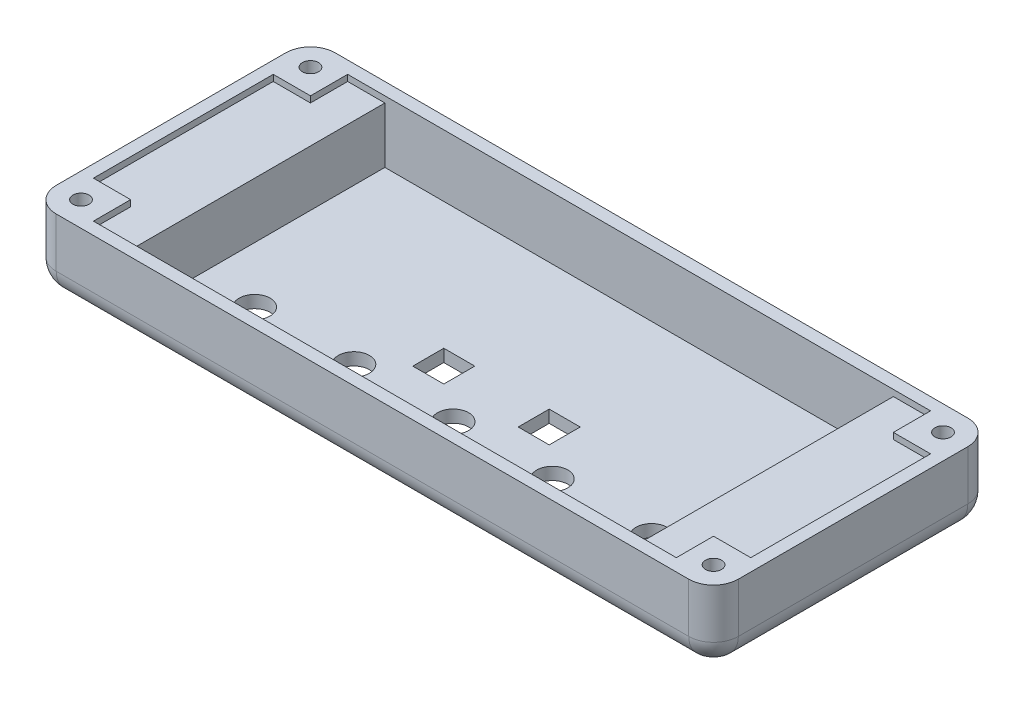
from build123d import *

# Parameters (mm, degrees)
SKETCH1_W           = 110
SKETCH1_H           = 45
BOSS_EXTRUDE1_DEPTH = 2
SKETCH3_W           = 110
SKETCH3_H           = 45
SKETCH3_W_2         = 106
SKETCH3_H_2         = 41
BOSS_EXTRUDE2_DEPTH = 10
SKETCH4_W           = 12
SKETCH4_H           = 41
BOSS_EXTRUDE3_DEPTH = 9
SKETCH5_W           = 6
SKETCH5_H           = 6
BOSS_EXTRUDE4_DEPTH = 1
SKETCH6_W           = 6
SKETCH6_H           = 6
BOSS_EXTRUDE5_DEPTH = 1
FILLET1_R           = 4
FILLET2_R           = 4
SKETCH7_R           = 1.3
CUT_EXTRUDE1_DEPTH  = 8
SKETCH9_R           = 2.5
SKETCH9_W           = 5
SKETCH9_H           = 5
CUT_EXTRUDE3_DEPTH  = 5
CUT_EXTRUDE4_DEPTH  = 1


with BuildPart() as part:
    # Sketch1 → Boss-Extrude1 (new body)
    with BuildSketch(Plane(origin=(0, 0, 0), x_dir=(1, 0, 0), z_dir=(0, 1, 0))):
        Rectangle(SKETCH1_W, SKETCH1_H)
    extrude(amount=BOSS_EXTRUDE1_DEPTH)

    # Sketch3 → Boss-Extrude2 (add)
    with BuildSketch(Plane(origin=(0, 2, 0), x_dir=(1, 0, 0), z_dir=(0, 1, 0))):
        Rectangle(SKETCH3_W, SKETCH3_H)
        Rectangle(SKETCH3_W_2, SKETCH3_H_2, mode=Mode.SUBTRACT)
    extrude(amount=BOSS_EXTRUDE2_DEPTH)

    # Sketch4 → Boss-Extrude3 (add)
    with BuildSketch(Plane(origin=(0, 2, 0), x_dir=(1, 0, 0), z_dir=(0, 1, 0))):
        with Locations((-47, 0)):
            Rectangle(SKETCH4_W, SKETCH4_H)
        with Locations((47, 0)):
            Rectangle(SKETCH4_W, SKETCH4_H)
    extrude(amount=BOSS_EXTRUDE3_DEPTH)

    # Sketch5 → Boss-Extrude4 (add)
    with BuildSketch(Plane(origin=(0, 11, 0), x_dir=(1, 0, 0), z_dir=(0, 1, 0))):
        with Locations((-50, 17.5)):
            Rectangle(SKETCH5_W, SKETCH5_H)
        with Locations((-50, -17.5)):
            Rectangle(SKETCH5_W, SKETCH5_H)
    extrude(amount=BOSS_EXTRUDE4_DEPTH)

    # Sketch6 → Boss-Extrude5 (add)
    with BuildSketch(Plane(origin=(0, 11, 0), x_dir=(1, 0, 0), z_dir=(0, 1, 0))):
        with Locations((50, 17.5)):
            Rectangle(SKETCH6_W, SKETCH6_H)
        with Locations((50, -17.5)):
            Rectangle(SKETCH6_W, SKETCH6_H)
    extrude(amount=BOSS_EXTRUDE5_DEPTH)

    # Fillet1
    fillet1_edges = [part.edges().sort_by_distance(p)[0] for p in [
        (55, 6, 22.5),
        (-55, 6, 22.5),
        (-55, 6, -22.5),
        (55, 6, -22.5),
    ]]
    fillet(fillet1_edges, radius=FILLET1_R)

    # Fillet2
    fillet2_edges = [part.edges().sort_by_distance(p)[0] for p in [
        (0, 0, -22.5),
        (55, 0, 0),
        (0, 0, 22.5),
        (-55, 0, 0),
        (-53.828427125, 0, -21.328427125),
        (-53.828427125, 0, 21.328427125),
        (53.828427125, 0, 21.328427125),
        (53.828427125, 0, -21.328427125),
    ]]
    fillet(fillet2_edges, radius=FILLET2_R)

    # Sketch7 → Cut-Extrude1 (cut)
    with BuildSketch(Plane(origin=(0, 12, 0), x_dir=(1, 0, 0), z_dir=(0, 1, 0))):
        with Locations(Location((-51, 18.5, 0), (0, 0, 270))):
            Circle(SKETCH7_R)
        with Locations(Location((51, 18.5, 0), (0, 0, 270))):
            Circle(SKETCH7_R)
        with Locations(Location((51, -18.5, 0), (0, 0, 270))):
            Circle(SKETCH7_R)
        with Locations(Location((-51, -18.5, 0), (0, 0, 270))):
            Circle(SKETCH7_R)
    extrude(amount=-CUT_EXTRUDE1_DEPTH, mode=Mode.SUBTRACT)

    # Sketch9 → Cut-Extrude3 (cut)
    with BuildSketch(Plane.XZ):
        with Locations(Location((-32, 9.5, 0), (0, 0, 270))):
            Circle(SKETCH9_R)
        with Locations(Location((-16, 9.5, 0), (0, 0, 270))):
            Circle(SKETCH9_R)
        with Locations(Location((0, 9.5, 0), (0, 0, 270))):
            Circle(SKETCH9_R)
        with Locations(Location((16, 9.5, 0), (0, 0, 270))):
            Circle(SKETCH9_R)
        with Locations(Location((32, 9.5, 0), (0, 0, 270))):
            Circle(SKETCH9_R)
        with Locations((-8.5, 2.5)):
            Rectangle(SKETCH9_W, SKETCH9_H)
        with Locations((8.5, 2.5)):
            Rectangle(SKETCH9_W, SKETCH9_H)
    extrude(amount=-CUT_EXTRUDE3_DEPTH, mode=Mode.SUBTRACT)

    # Sketch10 → Cut-Extrude4 (cut)
    # profile 1 of 27: a face of its own
    with BuildSketch(Plane.XZ):
        with BuildLine():
            Line((-36.101582615, 13.885817308), (-35.932512102, 13.987179487))
            add(Edge.make_bspline(
                [(-35.932512102, 13.987179487), (-35.916787395, 13.960856981), (-35.886659463, 13.910424076), (-35.836401544, 13.842276625), (-35.784325594, 13.784355392), (-35.730045975, 13.736997331), (-35.673894005, 13.699712253), (-35.615503117, 13.673310977), (-35.555070082, 13.656844706), (-35.513942184, 13.654844656), (-35.493409538, 13.653846154)],
                knots=[0, 0, 0, 0, 1.272034388, 2.437168799, 3.508375237, 4.49857839, 5.41946034, 6.295179144, 7.148887113, 8, 8, 8, 8], degree=3))
            add(Edge.make_bspline(
                [(-35.493409538, 13.653846154), (-35.475874189, 13.654334538), (-35.441110319, 13.655302761), (-35.389931894, 13.664606077), (-35.340228007, 13.678898722), (-35.293023071, 13.699367825), (-35.248968434, 13.724132674), (-35.210336037, 13.754044776), (-35.176938258, 13.787534036), (-35.149618764, 13.824895553), (-35.128658744, 13.865076781), (-35.11254899, 13.906320182), (-35.103608948, 13.949273649), (-35.102262232, 13.978193914), (-35.101582615, 13.992788462)],
                knots=[0, 0, 0, 0, 1.095163259, 2.171163733, 3.241058638, 4.321873601, 5.38011039, 6.391990106, 7.366004449, 8.327778327, 9.272591725, 10.192022065, 11.087607919, 12, 12, 12, 12], degree=3))
            add(Edge.make_bspline(
                [(-35.101582615, 13.992788462), (-35.102425078, 14.009440376), (-35.104137683, 14.043291284), (-35.118612814, 14.093233943), (-35.141383812, 14.142658268), (-35.162391037, 14.17323042), (-35.173297358, 14.189102564)],
                knots=[0, 0, 0, 0, 0.938893495, 1.908633276, 2.914225137, 4, 4, 4, 4], degree=3))
            add(Edge.make_bspline(
                [(-35.173297358, 14.189102564), (-35.182251995, 14.200557892), (-35.201051135, 14.22460692), (-35.233369713, 14.260404197), (-35.271293207, 14.297329008), (-35.31352381, 14.336791326), (-35.361599861, 14.376955781), (-35.414015583, 14.419737654), (-35.472109217, 14.463509984), (-35.512851786, 14.492865736), (-35.533874281, 14.508012821)],
                knots=[0, 0, 0, 0, 0.722233717, 1.516239348, 2.393582979, 3.351407094, 4.387010283, 5.505090956, 6.712668013, 8, 8, 8, 8], degree=3))
            add(Edge.make_bspline(
                [(-35.533874281, 14.508012821), (-35.554916565, 14.523000585), (-35.595147809, 14.551656049), (-35.651409856, 14.594184211), (-35.701720977, 14.633066422), (-35.745857558, 14.668668715), (-35.783800185, 14.700995918), (-35.815847848, 14.729737597), (-35.841184167, 14.755671061), (-35.85527307, 14.772494685), (-35.86159864, 14.780048077)],
                knots=[0, 0, 0, 0, 1.452282411, 2.77665338, 3.964542531, 5.026858415, 5.96415736, 6.766646006, 7.446254459, 8, 8, 8, 8], degree=3))
            add(Edge.make_bspline(
                [(-35.86159864, 14.780048077), (-35.870440095, 14.791820098), (-35.887828001, 14.814971357), (-35.910780005, 14.85115699), (-35.930288098, 14.888198856), (-35.945580859, 14.926196493), (-35.958458698, 14.964616452), (-35.967120373, 15.003960021), (-35.972544028, 15.044050661), (-35.973099449, 15.071029804), (-35.973377486, 15.084535256)],
                knots=[0, 0, 0, 0, 1.068054152, 2.10047183, 3.106115577, 4.101338837, 5.06977816, 6.043150881, 7.020423561, 8, 8, 8, 8], degree=3))
            add(Edge.make_bspline(
                [(-35.973377486, 15.084535256), (-35.972631653, 15.105695128), (-35.971155927, 15.147562593), (-35.958675631, 15.208723067), (-35.938976835, 15.267115306), (-35.911379756, 15.322161211), (-35.875804126, 15.372427485), (-35.834634998, 15.418492335), (-35.785599863, 15.457217239), (-35.731798364, 15.491052701), (-35.672909008, 15.517536087), (-35.611199921, 15.53751379), (-35.546573022, 15.548833366), (-35.502799803, 15.550457803), (-35.480589025, 15.551282051)],
                knots=[0, 0, 0, 0, 1.005424448, 1.989358655, 2.955360095, 3.929531133, 4.905563448, 5.876582895, 6.856512386, 7.866279853, 8.892233794, 9.918561126, 10.94386622, 12, 12, 12, 12], degree=3))
            add(Edge.make_bspline(
                [(-35.480589025, 15.551282051), (-35.457020968, 15.550469165), (-35.410151624, 15.548852593), (-35.341209215, 15.53479686), (-35.274831663, 15.511539334), (-35.221435511, 15.485145815), (-35.179645362, 15.458785006), (-35.147775229, 15.434773678), (-35.115479543, 15.407130758), (-35.082497797, 15.375782618), (-35.049388849, 15.340441617), (-35.015661162, 15.301349795), (-34.981235865, 15.258746049), (-34.95908966, 15.228332048), (-34.947736461, 15.212740385)],
                knots=[0, 0, 0, 0, 1.286793592, 2.559021753, 3.825965368, 5.121522368, 5.803751409, 6.523245864, 7.299691795, 8.125521123, 9.008227632, 9.944561021, 10.946284179, 12, 12, 12, 12], degree=3))
            Line((-34.947736461, 15.212740385), (-35.109996076, 15.08974359))
            add(Edge.make_bspline(
                [(-35.109996076, 15.08974359), (-35.119793752, 15.102365699), (-35.138661785, 15.126672929), (-35.167307206, 15.160713681), (-35.194306433, 15.191808812), (-35.220906661, 15.218817456), (-35.245703022, 15.243218676), (-35.269769904, 15.264109965), (-35.292760961, 15.28169602), (-35.321742053, 15.300463768), (-35.358152178, 15.319067485), (-35.403857627, 15.334809815), (-35.451621213, 15.34426985), (-35.484152431, 15.345520643), (-35.500621076, 15.346153846)],
                knots=[0, 0, 0, 0, 1.181633172, 2.275549214, 3.290209073, 4.226197932, 5.078386478, 5.862611352, 6.581680152, 7.217281963, 8.414376989, 9.595101626, 10.782541182, 12, 12, 12, 12], degree=3))
            add(Edge.make_bspline(
                [(-35.500621076, 15.346153846), (-35.521281946, 15.345461446), (-35.561124488, 15.344126218), (-35.617690337, 15.329543369), (-35.668601151, 15.306582306), (-35.712345474, 15.274402319), (-35.748766604, 15.236276037), (-35.77511258, 15.192402406), (-35.790969817, 15.143955319), (-35.792904834, 15.110160086), (-35.793890307, 15.092948718)],
                knots=[0, 0, 0, 0, 1.14458467, 2.207223713, 3.21896685, 4.227309161, 5.202851033, 6.127160689, 7.046193047, 8, 8, 8, 8], degree=3))
            add(Edge.make_bspline(
                [(-35.793890307, 15.092948718), (-35.793665663, 15.082233587), (-35.793216008, 15.060785805), (-35.786944695, 15.029099278), (-35.778887936, 14.997492798), (-35.766120718, 14.966108465), (-35.74849483, 14.934397403), (-35.725349015, 14.901813553), (-35.696198551, 14.868069719), (-35.67386883, 14.846122649), (-35.66207941, 14.834535256)],
                knots=[0, 0, 0, 0, 0.858281714, 1.717966888, 2.583508476, 3.4729293, 4.427298488, 5.488583878, 6.674047936, 8, 8, 8, 8], degree=3))
            add(Edge.make_bspline(
                [(-35.66207941, 14.834535256), (-35.657701482, 14.830628385), (-35.64730053, 14.821346551), (-35.628285715, 14.806150962), (-35.603175545, 14.787406521), (-35.572625715, 14.764213769), (-35.536072937, 14.737310076), (-35.493513191, 14.707039441), (-35.445420886, 14.672419178), (-35.411294077, 14.648214869), (-35.393249281, 14.635416667)],
                knots=[0, 0, 0, 0, 0.420754252, 0.999615792, 1.744751191, 2.668019286, 3.750313428, 4.999500688, 6.413464383, 8, 8, 8, 8], degree=3))
            add(Edge.make_bspline(
                [(-35.393249281, 14.635416667), (-35.371543045, 14.619621604), (-35.329511927, 14.589036654), (-35.269707596, 14.543084837), (-35.215482563, 14.498143255), (-35.166646446, 14.454498908), (-35.122716784, 14.412482855), (-35.084180944, 14.371589609), (-35.050646269, 14.332112139), (-35.014543859, 14.281499239), (-34.977653676, 14.219338619), (-34.945972815, 14.143179626), (-34.925996616, 14.066724586), (-34.923384322, 14.015337822), (-34.922095435, 13.989983974)],
                knots=[0, 0, 0, 0, 1.163667725, 2.253281268, 3.268753668, 4.215851969, 5.092017293, 5.902905408, 6.650798638, 7.335211899, 8.59617414, 9.77448103, 10.901945474, 12, 12, 12, 12], degree=3))
            add(Edge.make_bspline(
                [(-34.922095435, 13.989983974), (-34.922470943, 13.97205348), (-34.923214666, 13.936540689), (-34.931763759, 13.884394931), (-34.944289282, 13.83374872), (-34.963167702, 13.785228084), (-34.986209506, 13.737945363), (-35.015447362, 13.693140848), (-35.049337468, 13.649822906), (-35.088213905, 13.609146625), (-35.13075442, 13.571805942), (-35.175716532, 13.538589335), (-35.22317383, 13.510893151), (-35.272868869, 13.488292669), (-35.324813061, 13.470616374), (-35.378988937, 13.45780902), (-35.435485801, 13.449948614), (-35.473886076, 13.44913275), (-35.493409538, 13.448717949)],
                knots=[0, 0, 0, 0, 0.983748083, 1.948392443, 2.894712957, 3.844097841, 4.80183111, 5.778335162, 6.776009319, 7.81870978, 8.863265674, 9.881300176, 10.883814829, 11.87499822, 12.874611388, 13.892143829, 14.928324115, 16, 16, 16, 16], degree=3))
            add(Edge.make_bspline(
                [(-35.493409538, 13.448717949), (-35.508515448, 13.449010052), (-35.538537025, 13.449590581), (-35.582942443, 13.454722742), (-35.62645078, 13.461983944), (-35.668516084, 13.473511984), (-35.709680319, 13.487498828), (-35.749764453, 13.504720732), (-35.788787913, 13.525359133), (-35.826969389, 13.54895629), (-35.864211774, 13.576417858), (-35.900165756, 13.608402713), (-35.936011005, 13.644028716), (-35.970689517, 13.684263324), (-36.004902742, 13.728456514), (-36.037976119, 13.777021761), (-36.070594243, 13.829694535), (-36.091060225, 13.866760298), (-36.101582615, 13.885817308)],
                knots=[0, 0, 0, 0, 0.915332311, 1.819136955, 2.706846663, 3.586547465, 4.459518054, 5.340707479, 6.227863349, 7.133153174, 8.059268498, 9.028702269, 10.047606654, 11.120612155, 12.245963614, 13.433783089, 14.680604001, 16, 16, 16, 16], degree=3))
        make_face()
    # profile 2 of 27: a face of its own
    with BuildSketch(Plane.XZ):
        Polygon((-34.742608256, 15.294871795), (-34.742608256, 15.5), (-33.691326204, 15.5), (-33.691326204, 15.294871795), (-34.12722364, 15.294871795), (-34.12722364, 13.5), (-34.30671082, 13.5), (-34.30671082, 15.294871795), align=None)
    # profile 3 of 27: a face of its own
    with BuildSketch(Plane.XZ):
        Polygon((-32.563121076, 15.5), (-31.640044153, 13.5), (-31.835156333, 13.5), (-32.13082941, 14.141025641), (-33.037480051, 14.141025641), (-33.341566589, 13.5), (-33.537480051, 13.5), (-32.588762102, 15.5), align=None)
        Polygon((-32.577944794, 15.110176282), (-32.940124281, 14.346153846), (-32.225380692, 14.346153846), align=None, mode=Mode.SUBTRACT)
    # profile 4 of 27: a face of its own
    with BuildSketch(Plane.XZ):
        Polygon((-31.511839025, 15.294871795), (-31.511839025, 15.5), (-30.460556974, 15.5), (-30.460556974, 15.294871795), (-30.89645441, 15.294871795), (-30.89645441, 13.5), (-31.075941589, 13.5), (-31.075941589, 15.294871795), align=None)
    # profile 5 of 27: a face of its own
    with BuildSketch(Plane.XZ):
        with BuildLine():
            Line((-30.152864666, 15.5), (-29.973377486, 15.5))
            Line((-29.973377486, 15.5), (-29.973377486, 14.301682692))
            add(Edge.make_bspline(
                [(-29.973377486, 14.301682692), (-29.973404197, 14.284722272), (-29.973454886, 14.252536951), (-29.973116306, 14.206726494), (-29.972168096, 14.165999374), (-29.97157029, 14.130198604), (-29.970240386, 14.099488463), (-29.969155787, 14.073702571), (-29.967761183, 14.052963027), (-29.966085116, 14.040859641), (-29.965364666, 14.035657051)],
                knots=[0, 0, 0, 0, 1.528628734, 2.90083645, 4.128790002, 5.200304208, 6.127813768, 6.898992206, 7.526736466, 8, 8, 8, 8], degree=3))
            add(Edge.make_bspline(
                [(-29.965364666, 14.035657051), (-29.962406118, 14.016887472), (-29.956655726, 13.980405913), (-29.942000653, 13.928458323), (-29.921533509, 13.881640347), (-29.897280342, 13.838491038), (-29.86531885, 13.800211403), (-29.827031116, 13.764947602), (-29.780643819, 13.734106571), (-29.72906633, 13.705906107), (-29.673474766, 13.683240345), (-29.616668328, 13.66610128), (-29.559500911, 13.655656194), (-29.521228817, 13.654446744), (-29.50222364, 13.653846154)],
                knots=[0, 0, 0, 0, 1.035780045, 2.013197591, 2.933192213, 3.817615948, 4.702609284, 5.640816605, 6.646850145, 7.73207398, 8.84249596, 9.914020372, 10.964143139, 12, 12, 12, 12], degree=3))
            add(Edge.make_bspline(
                [(-29.50222364, 13.653846154), (-29.485907217, 13.654459783), (-29.45336861, 13.655683496), (-29.405022079, 13.663261456), (-29.357936302, 13.676918923), (-29.311878771, 13.694541642), (-29.26870678, 13.717825979), (-29.228396241, 13.744723602), (-29.19241685, 13.776272674), (-29.159583709, 13.811187157), (-29.130992317, 13.850581328), (-29.106208807, 13.893597407), (-29.085908276, 13.940882748), (-29.075883405, 13.974113846), (-29.070733256, 13.991185897)],
                knots=[0, 0, 0, 0, 0.994687771, 1.983630487, 2.973142513, 3.978332533, 4.983357753, 5.956394766, 6.925816176, 7.893390482, 8.871859704, 9.88551698, 10.913711441, 12, 12, 12, 12], degree=3))
            add(Edge.make_bspline(
                [(-29.070733256, 13.991185897), (-29.069018898, 13.998242226), (-29.065198619, 14.013966569), (-29.061628879, 14.040550163), (-29.057910865, 14.071915514), (-29.055331111, 14.108287978), (-29.052816128, 14.149545677), (-29.051311514, 14.195903538), (-29.050616067, 14.24719323), (-29.050408821, 14.282985894), (-29.050300563, 14.301682692)],
                knots=[0, 0, 0, 0, 0.558680831, 1.244966039, 2.062412453, 2.990489873, 4.051219941, 5.244515665, 6.560634259, 8, 8, 8, 8], degree=3))
            Line((-29.050300563, 14.301682692), (-29.050300563, 15.5))
            Line((-29.050300563, 15.5), (-28.870813384, 15.5))
            Line((-28.870813384, 15.5), (-28.870813384, 14.292067308))
            add(Edge.make_bspline(
                [(-28.870813384, 14.292067308), (-28.870958596, 14.270296805), (-28.871241985, 14.227810347), (-28.873699457, 14.165552427), (-28.877617743, 14.106493581), (-28.883153793, 14.050625868), (-28.890489223, 13.998149206), (-28.898646492, 13.948603624), (-28.909034797, 13.902344771), (-28.921168169, 13.859011961), (-28.935038768, 13.817763096), (-28.953005138, 13.778615317), (-28.97324771, 13.740378517), (-28.997256083, 13.703631026), (-29.024234016, 13.668210138), (-29.054777833, 13.634330667), (-29.087877354, 13.601451212), (-29.124082817, 13.570415174), (-29.162797402, 13.541953073), (-29.20390595, 13.516925775), (-29.247092675, 13.495769423), (-29.292245319, 13.478354609), (-29.339383149, 13.465260552), (-29.388507354, 13.45550332), (-29.439729751, 13.44995915), (-29.474566697, 13.44913519), (-29.492207615, 13.448717949)],
                knots=[0, 0, 0, 0, 1.316592851, 2.569410997, 3.76748051, 4.895814652, 5.963796859, 6.97159953, 7.931736103, 8.829262218, 9.692595152, 10.560224239, 11.431080259, 12.30701507, 13.211635791, 14.121146779, 15.063487852, 16.031507147, 17.00238618, 17.966455255, 18.938106653, 19.907068911, 20.888905087, 21.893141452, 22.933117798, 24, 24, 24, 24], degree=3))
            add(Edge.make_bspline(
                [(-29.492207615, 13.448717949), (-29.511447102, 13.449166386), (-29.549194907, 13.450046218), (-29.60481666, 13.45508779), (-29.658139058, 13.464584015), (-29.709725273, 13.476675412), (-29.758872986, 13.493351833), (-29.806240668, 13.512836476), (-29.851017057, 13.536766339), (-29.893928559, 13.563391135), (-29.93382842, 13.593348071), (-29.970455508, 13.625999599), (-30.003870291, 13.660822672), (-30.033509546, 13.698194309), (-30.059864337, 13.737823856), (-30.082567316, 13.779823422), (-30.102060598, 13.824176745), (-30.112121494, 13.855007145), (-30.117207615, 13.870592949)],
                knots=[0, 0, 0, 0, 1.13879206, 2.234305948, 3.301075583, 4.341971843, 5.366689343, 6.369221514, 7.369726634, 8.367512178, 9.355451585, 10.318319045, 11.268648973, 12.207971039, 13.137398894, 14.081662264, 15.030215811, 16, 16, 16, 16], degree=3))
            add(Edge.make_bspline(
                [(-30.117207615, 13.870592949), (-30.120165991, 13.881240134), (-30.126582774, 13.904334116), (-30.133454373, 13.942554967), (-30.139230991, 13.986563491), (-30.144662739, 14.036362702), (-30.147867858, 14.091991197), (-30.150677823, 14.153424863), (-30.152884462, 14.220737984), (-30.152871449, 14.267626279), (-30.152864666, 14.292067308)],
                knots=[0, 0, 0, 0, 0.625038921, 1.35572334, 2.194682327, 3.136881307, 4.189498639, 5.346923369, 6.617055217, 8, 8, 8, 8], degree=3))
            Line((-30.152864666, 14.292067308), (-30.152864666, 15.5))
        make_face()
    # profile 6 of 27: a face of its own
    with BuildSketch(Plane.XZ):
        with BuildLine():
            Line((-28.563121076, 13.885817308), (-28.394050563, 13.987179487))
            add(Edge.make_bspline(
                [(-28.394050563, 13.987179487), (-28.378325856, 13.960856981), (-28.348197925, 13.910424076), (-28.297940005, 13.842276625), (-28.245864056, 13.784355392), (-28.191584437, 13.736997331), (-28.135432466, 13.699712253), (-28.077041578, 13.673310977), (-28.016608544, 13.656844706), (-27.975480646, 13.654844656), (-27.954947999, 13.653846154)],
                knots=[0, 0, 0, 0, 1.272034388, 2.437168799, 3.508375237, 4.49857839, 5.41946034, 6.295179144, 7.148887113, 8, 8, 8, 8], degree=3))
            add(Edge.make_bspline(
                [(-27.954947999, 13.653846154), (-27.93741265, 13.654334538), (-27.90264878, 13.655302761), (-27.851470356, 13.664606077), (-27.801766469, 13.678898722), (-27.754561533, 13.699367825), (-27.710506896, 13.724132674), (-27.671874498, 13.754044776), (-27.63847672, 13.787534036), (-27.611157225, 13.824895553), (-27.590197205, 13.865076781), (-27.574087452, 13.906320182), (-27.56514741, 13.949273649), (-27.563800694, 13.978193914), (-27.563121076, 13.992788462)],
                knots=[0, 0, 0, 0, 1.095163259, 2.171163733, 3.241058638, 4.321873601, 5.38011039, 6.391990106, 7.366004449, 8.327778327, 9.272591725, 10.192022065, 11.087607919, 12, 12, 12, 12], degree=3))
            add(Edge.make_bspline(
                [(-27.563121076, 13.992788462), (-27.563963539, 14.009440376), (-27.565676144, 14.043291284), (-27.580151276, 14.093233943), (-27.602922274, 14.142658268), (-27.623929499, 14.17323042), (-27.63483582, 14.189102564)],
                knots=[0, 0, 0, 0, 0.938893495, 1.908633276, 2.914225137, 4, 4, 4, 4], degree=3))
            add(Edge.make_bspline(
                [(-27.63483582, 14.189102564), (-27.643790456, 14.200557892), (-27.662589596, 14.22460692), (-27.694908175, 14.260404197), (-27.732831669, 14.297329008), (-27.775062271, 14.336791326), (-27.823138322, 14.376955781), (-27.875554045, 14.419737654), (-27.933647678, 14.463509984), (-27.974390248, 14.492865736), (-27.995412743, 14.508012821)],
                knots=[0, 0, 0, 0, 0.722233717, 1.516239348, 2.393582979, 3.351407094, 4.387010283, 5.505090956, 6.712668013, 8, 8, 8, 8], degree=3))
            add(Edge.make_bspline(
                [(-27.995412743, 14.508012821), (-28.016455026, 14.523000585), (-28.05668627, 14.551656049), (-28.112948317, 14.594184211), (-28.163259439, 14.633066422), (-28.20739602, 14.668668715), (-28.245338647, 14.700995918), (-28.27738631, 14.729737597), (-28.302722628, 14.755671061), (-28.316811532, 14.772494685), (-28.323137102, 14.780048077)],
                knots=[0, 0, 0, 0, 1.452282411, 2.77665338, 3.964542531, 5.026858415, 5.96415736, 6.766646006, 7.446254459, 8, 8, 8, 8], degree=3))
            add(Edge.make_bspline(
                [(-28.323137102, 14.780048077), (-28.331978556, 14.791820098), (-28.349366463, 14.814971357), (-28.372318466, 14.85115699), (-28.391826559, 14.888198856), (-28.40711932, 14.926196493), (-28.41999716, 14.964616452), (-28.428658834, 15.003960021), (-28.43408249, 15.044050661), (-28.434637911, 15.071029804), (-28.434915948, 15.084535256)],
                knots=[0, 0, 0, 0, 1.068054152, 2.10047183, 3.106115577, 4.101338837, 5.06977816, 6.043150881, 7.020423561, 8, 8, 8, 8], degree=3))
            add(Edge.make_bspline(
                [(-28.434915948, 15.084535256), (-28.434170114, 15.105695128), (-28.432694389, 15.147562593), (-28.420214093, 15.208723067), (-28.400515297, 15.267115306), (-28.372918218, 15.322161211), (-28.337342588, 15.372427485), (-28.296173459, 15.418492335), (-28.247138324, 15.457217239), (-28.193336825, 15.491052701), (-28.13444747, 15.517536087), (-28.072738382, 15.53751379), (-28.008111484, 15.548833366), (-27.964338264, 15.550457803), (-27.942127486, 15.551282051)],
                knots=[0, 0, 0, 0, 1.005424448, 1.989358655, 2.955360095, 3.929531133, 4.905563448, 5.876582895, 6.856512386, 7.866279853, 8.892233794, 9.918561126, 10.94386622, 12, 12, 12, 12], degree=3))
            add(Edge.make_bspline(
                [(-27.942127486, 15.551282051), (-27.918559429, 15.550469165), (-27.871690085, 15.548852593), (-27.802747676, 15.53479686), (-27.736370124, 15.511539334), (-27.682973973, 15.485145815), (-27.641183823, 15.458785006), (-27.60931369, 15.434773678), (-27.577018004, 15.407130758), (-27.544036259, 15.375782618), (-27.51092731, 15.340441617), (-27.477199623, 15.301349795), (-27.442774327, 15.258746049), (-27.420628121, 15.228332048), (-27.409274922, 15.212740385)],
                knots=[0, 0, 0, 0, 1.286793592, 2.559021753, 3.825965368, 5.121522368, 5.803751409, 6.523245864, 7.299691795, 8.125521123, 9.008227632, 9.944561021, 10.946284179, 12, 12, 12, 12], degree=3))
            Line((-27.409274922, 15.212740385), (-27.571534538, 15.08974359))
            add(Edge.make_bspline(
                [(-27.571534538, 15.08974359), (-27.581332213, 15.102365699), (-27.600200246, 15.126672929), (-27.628845667, 15.160713681), (-27.655844895, 15.191808812), (-27.682445123, 15.218817456), (-27.707241484, 15.243218676), (-27.731308365, 15.264109965), (-27.754299423, 15.28169602), (-27.783280515, 15.300463768), (-27.819690639, 15.319067485), (-27.865396089, 15.334809815), (-27.913159674, 15.34426985), (-27.945690892, 15.345520643), (-27.962159538, 15.346153846)],
                knots=[0, 0, 0, 0, 1.181633172, 2.275549214, 3.290209073, 4.226197932, 5.078386478, 5.862611352, 6.581680152, 7.217281963, 8.414376989, 9.595101626, 10.782541182, 12, 12, 12, 12], degree=3))
            add(Edge.make_bspline(
                [(-27.962159538, 15.346153846), (-27.982820408, 15.345461446), (-28.022662949, 15.344126218), (-28.079228798, 15.329543369), (-28.130139613, 15.306582306), (-28.173883935, 15.274402319), (-28.210305065, 15.236276037), (-28.236651042, 15.192402406), (-28.252508279, 15.143955319), (-28.254443295, 15.110160086), (-28.255428769, 15.092948718)],
                knots=[0, 0, 0, 0, 1.14458467, 2.207223713, 3.21896685, 4.227309161, 5.202851033, 6.127160689, 7.046193047, 8, 8, 8, 8], degree=3))
            add(Edge.make_bspline(
                [(-28.255428769, 15.092948718), (-28.255204125, 15.082233587), (-28.25475447, 15.060785805), (-28.248483157, 15.029099278), (-28.240426397, 14.997492798), (-28.227659179, 14.966108465), (-28.210033292, 14.934397403), (-28.186887477, 14.901813553), (-28.157737013, 14.868069719), (-28.135407291, 14.846122649), (-28.123617871, 14.834535256)],
                knots=[0, 0, 0, 0, 0.858281714, 1.717966888, 2.583508476, 3.4729293, 4.427298488, 5.488583878, 6.674047936, 8, 8, 8, 8], degree=3))
            add(Edge.make_bspline(
                [(-28.123617871, 14.834535256), (-28.119239944, 14.830628385), (-28.108838991, 14.821346551), (-28.089824177, 14.806150962), (-28.064714006, 14.787406521), (-28.034164177, 14.764213769), (-27.997611399, 14.737310076), (-27.955051652, 14.707039441), (-27.906959348, 14.672419178), (-27.872832539, 14.648214869), (-27.854787743, 14.635416667)],
                knots=[0, 0, 0, 0, 0.420754252, 0.999615792, 1.744751191, 2.668019286, 3.750313428, 4.999500688, 6.413464383, 8, 8, 8, 8], degree=3))
            add(Edge.make_bspline(
                [(-27.854787743, 14.635416667), (-27.833081507, 14.619621604), (-27.791050389, 14.589036654), (-27.731246057, 14.543084837), (-27.677021024, 14.498143255), (-27.628184908, 14.454498908), (-27.584255246, 14.412482855), (-27.545719406, 14.371589609), (-27.512184731, 14.332112139), (-27.47608232, 14.281499239), (-27.439192138, 14.219338619), (-27.407511277, 14.143179626), (-27.387535078, 14.066724586), (-27.384922783, 14.015337822), (-27.383633897, 13.989983974)],
                knots=[0, 0, 0, 0, 1.163667725, 2.253281268, 3.268753668, 4.215851969, 5.092017293, 5.902905408, 6.650798638, 7.335211899, 8.59617414, 9.77448103, 10.901945474, 12, 12, 12, 12], degree=3))
            add(Edge.make_bspline(
                [(-27.383633897, 13.989983974), (-27.384009404, 13.97205348), (-27.384753127, 13.936540689), (-27.393302221, 13.884394931), (-27.405827744, 13.83374872), (-27.424706163, 13.785228084), (-27.447747968, 13.737945363), (-27.476985824, 13.693140848), (-27.510875929, 13.649822906), (-27.549752366, 13.609146625), (-27.592292882, 13.571805942), (-27.637254993, 13.538589335), (-27.684712292, 13.510893151), (-27.73440733, 13.488292669), (-27.786351523, 13.470616374), (-27.840527399, 13.45780902), (-27.897024263, 13.449948614), (-27.935424538, 13.44913275), (-27.954947999, 13.448717949)],
                knots=[0, 0, 0, 0, 0.983748083, 1.948392443, 2.894712957, 3.844097841, 4.80183111, 5.778335162, 6.776009319, 7.81870978, 8.863265674, 9.881300176, 10.883814829, 11.87499822, 12.874611388, 13.892143829, 14.928324115, 16, 16, 16, 16], degree=3))
            add(Edge.make_bspline(
                [(-27.954947999, 13.448717949), (-27.97005391, 13.449010052), (-28.000075487, 13.449590581), (-28.044480905, 13.454722742), (-28.087989242, 13.461983944), (-28.130054546, 13.473511984), (-28.171218781, 13.487498828), (-28.211302915, 13.504720732), (-28.250326374, 13.525359133), (-28.28850785, 13.54895629), (-28.325750236, 13.576417858), (-28.361704217, 13.608402713), (-28.397549466, 13.644028716), (-28.432227978, 13.684263324), (-28.466441204, 13.728456514), (-28.499514581, 13.777021761), (-28.532132705, 13.829694535), (-28.552598687, 13.866760298), (-28.563121076, 13.885817308)],
                knots=[0, 0, 0, 0, 0.915332311, 1.819136955, 2.706846663, 3.586547465, 4.459518054, 5.340707479, 6.227863349, 7.133153174, 8.059268498, 9.028702269, 10.047606654, 11.120612155, 12.245963614, 13.433783089, 14.680604001, 16, 16, 16, 16], degree=3))
        make_face()
    # profile 7 of 27: a face of its own
    with BuildSketch(Plane.XZ):
        with BuildLine():
            Line((-21.274604259, 15.5), (-20.882376695, 15.5))
            add(Edge.make_bspline(
                [(-20.882376695, 15.5), (-20.855399034, 15.499970345), (-20.803708638, 15.499913525), (-20.729585749, 15.498190813), (-20.662265903, 15.495889846), (-20.601894256, 15.492700193), (-20.548285058, 15.488930713), (-20.501680886, 15.483643833), (-20.461715426, 15.478123664), (-20.437768883, 15.472511432), (-20.426847849, 15.469951923)],
                knots=[0, 0, 0, 0, 1.415646017, 2.712440637, 3.8905458, 4.950247383, 5.884950622, 6.709939814, 7.411656543, 8, 8, 8, 8], degree=3))
            add(Edge.make_bspline(
                [(-20.426847849, 15.469951923), (-20.413022972, 15.466167952), (-20.385698985, 15.458689174), (-20.346326961, 15.443709903), (-20.30886762, 15.425948666), (-20.273192444, 15.405706414), (-20.239739825, 15.382114664), (-20.208010659, 15.356129739), (-20.178284956, 15.3271517), (-20.150729875, 15.295505563), (-20.125424276, 15.261722586), (-20.103635886, 15.225298454), (-20.085391756, 15.186846281), (-20.069744173, 15.146392812), (-20.058482199, 15.103598341), (-20.049998256, 15.05876022), (-20.044613326, 15.011883254), (-20.044097576, 14.979849044), (-20.043835028, 14.963541667)],
                knots=[0, 0, 0, 0, 0.999701418, 1.975846123, 2.934577507, 3.890451536, 4.834027766, 5.787354733, 6.749476667, 7.726910423, 8.712836071, 9.690891519, 10.682875813, 11.679750201, 12.712814741, 13.765529915, 14.8625177, 16, 16, 16, 16], degree=3))
            add(Edge.make_bspline(
                [(-20.043835028, 14.963541667), (-20.044075842, 14.947097223), (-20.044547011, 14.914922558), (-20.050202032, 14.867852393), (-20.057819284, 14.822870456), (-20.069531885, 14.780076484), (-20.08487227, 14.739724615), (-20.102867729, 14.701198197), (-20.124572603, 14.66515267), (-20.149512506, 14.631457174), (-20.177256274, 14.600080082), (-20.207686524, 14.571248771), (-20.240680406, 14.545132006), (-20.276133062, 14.521671238), (-20.314390118, 14.501410507), (-20.354871349, 14.483263475), (-20.397928616, 14.468022869), (-20.427724338, 14.460005691), (-20.44287349, 14.455929487)],
                knots=[0, 0, 0, 0, 1.121902311, 2.195077645, 3.232258892, 4.234102512, 5.217864754, 6.176164875, 7.132989551, 8.084763148, 9.034132444, 9.988522005, 10.94243251, 11.903244335, 12.886203696, 13.894208494, 14.929344452, 16, 16, 16, 16], degree=3))
            add(Edge.make_bspline(
                [(-20.44287349, 14.455929487), (-20.455403395, 14.453264927), (-20.48286341, 14.447425387), (-20.528087823, 14.440906269), (-20.580742329, 14.435341926), (-20.640755061, 14.431169847), (-20.708072149, 14.427598208), (-20.782730011, 14.424759297), (-20.864875198, 14.423199381), (-20.922173051, 14.423118928), (-20.952088233, 14.423076923)],
                knots=[0, 0, 0, 0, 0.601384939, 1.31797006, 2.144135048, 3.087295005, 4.142315834, 5.309527816, 6.595305764, 8, 8, 8, 8], degree=3))
            Line((-20.952088233, 14.423076923), (-21.095117079, 14.423076923))
            Line((-21.095117079, 14.423076923), (-21.095117079, 13.5))
            Line((-21.095117079, 13.5), (-21.274604259, 13.5))
            Line((-21.274604259, 13.5), (-21.274604259, 15.5))
        make_face()
        with BuildLine():
            Line((-21.095117079, 15.294871795), (-21.095117079, 14.628205128))
            Line((-21.095117079, 14.628205128), (-20.744956823, 14.623798077))
            add(Edge.make_bspline(
                [(-20.744956823, 14.623798077), (-20.727859723, 14.623789241), (-20.694854123, 14.623772182), (-20.647176281, 14.626049453), (-20.602942402, 14.628678329), (-20.562288359, 14.632527428), (-20.525195825, 14.637968146), (-20.491602952, 14.643460568), (-20.461770219, 14.651406489), (-20.426856389, 14.662105386), (-20.387951619, 14.680352595), (-20.345627306, 14.706838246), (-20.309758399, 14.740598651), (-20.278719372, 14.778557412), (-20.254087442, 14.820785486), (-20.236055446, 14.865967735), (-20.225460499, 14.913640792), (-20.224039817, 14.946262586), (-20.223322208, 14.962740385)],
                knots=[0, 0, 0, 0, 1.160613943, 2.240541288, 3.23993089, 4.169200891, 5.011653406, 5.7853311, 6.478053781, 7.106038997, 8.262395093, 9.384106736, 10.481365981, 11.59014053, 12.70357646, 13.786202915, 14.881775077, 16, 16, 16, 16], degree=3))
            add(Edge.make_bspline(
                [(-20.223322208, 14.962740385), (-20.22404372, 14.978819535), (-20.225477997, 15.010782896), (-20.23613849, 15.057627902), (-20.254052384, 15.102334019), (-20.278884724, 15.144032925), (-20.309022512, 15.181855099), (-20.344050708, 15.2147106), (-20.383886858, 15.241123002), (-20.42094299, 15.258170591), (-20.453857953, 15.26857932), (-20.482447644, 15.275862086), (-20.51472803, 15.281676718), (-20.550709618, 15.286385005), (-20.590113523, 15.290415555), (-20.633278275, 15.293150399), (-20.680040356, 15.294751231), (-20.71250354, 15.294830634), (-20.729331823, 15.294871795)],
                knots=[0, 0, 0, 0, 1.120700087, 2.227813068, 3.331159281, 4.466773991, 5.599788987, 6.693661531, 7.80175334, 8.91857717, 9.525282508, 10.207424825, 10.974604443, 11.810962634, 12.737642355, 13.736264703, 14.826523623, 16, 16, 16, 16], degree=3))
            Line((-20.729331823, 15.294871795), (-21.095117079, 15.294871795))
        make_face(mode=Mode.SUBTRACT)
    # profile 8 of 27: a face of its own
    with BuildSketch(Plane.XZ):
        with BuildLine():
            Line((-19.633578618, 15.5), (-19.233338233, 15.5))
            add(Edge.make_bspline(
                [(-19.233338233, 15.5), (-19.206629017, 15.499911094), (-19.155344363, 15.499740384), (-19.081873923, 15.498788519), (-19.015115582, 15.496060316), (-18.955104245, 15.493712554), (-18.901841014, 15.489431445), (-18.855162562, 15.485339646), (-18.815283877, 15.479983269), (-18.791143391, 15.475008741), (-18.780213233, 15.47275641)],
                knots=[0, 0, 0, 0, 1.410062039, 2.707475311, 3.878576406, 4.937260626, 5.877586885, 6.699081471, 7.410979367, 8, 8, 8, 8], degree=3))
            add(Edge.make_bspline(
                [(-18.780213233, 15.47275641), (-18.765580877, 15.469141116), (-18.736628311, 15.461987651), (-18.694942559, 15.446867879), (-18.655220088, 15.429370951), (-18.617625903, 15.408820253), (-18.582348308, 15.385063236), (-18.549023559, 15.358510023), (-18.517500437, 15.329305906), (-18.489053791, 15.296714568), (-18.462231476, 15.262522277), (-18.439609404, 15.225548701), (-18.420108558, 15.186884971), (-18.404582548, 15.146137875), (-18.392080849, 15.103702577), (-18.383265855, 15.059194693), (-18.377979463, 15.012816993), (-18.377441259, 14.981183903), (-18.377168361, 14.965144231)],
                knots=[0, 0, 0, 0, 1.027469482, 2.033020251, 3.019912614, 3.986113645, 4.951240523, 5.91722682, 6.890402269, 7.87763091, 8.8651537, 9.85103654, 10.82876324, 11.815024772, 12.821070561, 13.842952187, 14.906261191, 16, 16, 16, 16], degree=3))
            add(Edge.make_bspline(
                [(-18.377168361, 14.965144231), (-18.378007789, 14.9384956), (-18.379645729, 14.886497218), (-18.394917217, 14.811033857), (-18.419932371, 14.740639963), (-18.454402822, 14.67540417), (-18.498299666, 14.616598087), (-18.551056689, 14.564946398), (-18.612703324, 14.521723591), (-18.670091505, 14.49175056), (-18.720785333, 14.472554612), (-18.762518655, 14.459048121), (-18.808042642, 14.448612712), (-18.856921119, 14.439264066), (-18.909357493, 14.432205955), (-18.965226087, 14.427036472), (-19.024566745, 14.423805587), (-19.065331928, 14.423324441), (-19.086302977, 14.423076923)],
                knots=[0, 0, 0, 0, 1.260483769, 2.459530307, 3.627416485, 4.787058657, 5.939039949, 7.08810263, 8.267026773, 9.491475466, 10.141966685, 10.831826277, 11.566392101, 12.351337768, 13.187381173, 14.07005841, 15.007169909, 16, 16, 16, 16], degree=3))
            Line((-19.086302977, 14.423076923), (-18.351527336, 13.5))
            Line((-18.351527336, 13.5), (-18.573482464, 13.5))
            Line((-18.573482464, 13.5), (-19.308258105, 14.423076923))
            Line((-19.308258105, 14.423076923), (-19.454091438, 14.423076923))
            Line((-19.454091438, 14.423076923), (-19.454091438, 13.5))
            Line((-19.454091438, 13.5), (-19.633578618, 13.5))
            Line((-19.633578618, 13.5), (-19.633578618, 15.5))
        make_face()
        with BuildLine():
            Line((-19.454091438, 15.294871795), (-19.454091438, 14.628205128))
            Line((-19.454091438, 14.628205128), (-19.087905541, 14.625400641))
            add(Edge.make_bspline(
                [(-19.087905541, 14.625400641), (-19.070808376, 14.625393077), (-19.0376692, 14.625378416), (-18.989725963, 14.627660574), (-18.9450859, 14.630256756), (-18.903919755, 14.634227811), (-18.866209141, 14.639345566), (-18.831972905, 14.645747271), (-18.801155161, 14.653205593), (-18.765213139, 14.664749379), (-18.725077978, 14.683038532), (-18.681460001, 14.709647389), (-18.644315808, 14.743115457), (-18.612934172, 14.781386003), (-18.587717355, 14.82346386), (-18.569939038, 14.868844642), (-18.558657642, 14.916382698), (-18.557327045, 14.949055902), (-18.556655541, 14.965544872)],
                knots=[0, 0, 0, 0, 1.146690395, 2.22261258, 3.21895312, 4.145990853, 4.996080663, 5.770904154, 6.481378293, 7.121626537, 8.300444488, 9.431385265, 10.535395872, 11.636531494, 12.74115979, 13.810798291, 14.895190096, 16, 16, 16, 16], degree=3))
            add(Edge.make_bspline(
                [(-18.556655541, 14.965544872), (-18.557342467, 14.981628628), (-18.558703705, 15.013500765), (-18.569817287, 15.060161285), (-18.588611219, 15.104199542), (-18.613938212, 15.145436391), (-18.644794872, 15.18286824), (-18.680976479, 15.214895184), (-18.721493734, 15.24132345), (-18.75936299, 15.258211667), (-18.793211111, 15.268565869), (-18.822599488, 15.275852248), (-18.855806047, 15.281706231), (-18.892992023, 15.286396551), (-18.93399867, 15.290427948), (-18.979033327, 15.29314325), (-19.027797202, 15.294751172), (-19.061595448, 15.294830652), (-19.079091438, 15.294871795)],
                knots=[0, 0, 0, 0, 1.101028733, 2.181837193, 3.264309656, 4.369019818, 5.486613113, 6.575447106, 7.666700264, 8.788928104, 9.402425223, 10.0903467, 10.862060571, 11.710948788, 12.657782767, 13.684531032, 14.801375019, 16, 16, 16, 16], degree=3))
            Line((-19.079091438, 15.294871795), (-19.454091438, 15.294871795))
        make_face(mode=Mode.SUBTRACT)
    # profile 9 of 27: a face of its own
    with BuildSketch(Plane.XZ):
        Polygon((-17.941270926, 15.5), (-16.813065797, 15.5), (-16.813065797, 15.294871795), (-17.761783746, 15.294871795), (-17.761783746, 14.679487179), (-16.813065797, 14.679487179), (-16.813065797, 14.474358974), (-17.761783746, 14.474358974), (-17.761783746, 13.705128205), (-16.813065797, 13.705128205), (-16.813065797, 13.5), (-17.941270926, 13.5), align=None)
    # profile 10 of 27: a face of its own
    with BuildSketch(Plane.XZ):
        Polygon((-16.454091438, 15.5), (-16.274604259, 15.5), (-16.274604259, 14.679487179), (-15.248963233, 14.679487179), (-15.248963233, 15.5), (-15.069476054, 15.5), (-15.069476054, 13.5), (-15.248963233, 13.5), (-15.248963233, 14.474358974), (-16.274604259, 14.474358974), (-16.274604259, 13.5), (-16.454091438, 13.5), align=None)
    # profile 11 of 27: a face of its own
    with BuildSketch(Plane.XZ):
        Polygon((-14.556655541, 15.5), (-13.428450413, 15.5), (-13.428450413, 15.294871795), (-14.377168361, 15.294871795), (-14.377168361, 14.679487179), (-13.428450413, 14.679487179), (-13.428450413, 14.474358974), (-14.377168361, 14.474358974), (-14.377168361, 13.705128205), (-13.428450413, 13.705128205), (-13.428450413, 13.5), (-14.556655541, 13.5), align=None)
    # profile 12 of 27: a face of its own
    with BuildSketch(Plane.XZ):
        Polygon((-12.248963233, 15.5), (-11.32588631, 13.5), (-11.52099849, 13.5), (-11.816671567, 14.141025641), (-12.723322208, 14.141025641), (-13.027408746, 13.5), (-13.223322208, 13.5), (-12.274604259, 15.5), align=None)
        Polygon((-12.263786951, 15.110176282), (-12.625966438, 14.346153846), (-11.911222849, 14.346153846), align=None, mode=Mode.SUBTRACT)
    # profile 13 of 27: a face of its own
    with BuildSketch(Plane.XZ):
        Polygon((-11.197681182, 15.294871795), (-11.197681182, 15.5), (-10.146399131, 15.5), (-10.146399131, 15.294871795), (-10.582296567, 15.294871795), (-10.582296567, 13.5), (-10.761783746, 13.5), (-10.761783746, 15.294871795), align=None)
    # profile 14 of 27: a face of its own
    with BuildSketch(Plane.XZ):
        with BuildLine():
            Line((-3.448717949, 13.885817308), (-3.279647436, 13.987179487))
            add(Edge.make_bspline(
                [(-3.279647436, 13.987179487), (-3.263922729, 13.960856981), (-3.233794797, 13.910424076), (-3.183536878, 13.842276625), (-3.131460928, 13.784355392), (-3.077181309, 13.736997331), (-3.021029339, 13.699712253), (-2.962638451, 13.673310977), (-2.902205416, 13.656844706), (-2.861077518, 13.654844656), (-2.840544872, 13.653846154)],
                knots=[0, 0, 0, 0, 1.272034388, 2.437168799, 3.508375237, 4.49857839, 5.41946034, 6.295179144, 7.148887113, 8, 8, 8, 8], degree=3))
            add(Edge.make_bspline(
                [(-2.840544872, 13.653846154), (-2.823009523, 13.654334538), (-2.788245653, 13.655302761), (-2.737067228, 13.664606077), (-2.687363341, 13.678898722), (-2.640158405, 13.699367825), (-2.596103768, 13.724132674), (-2.557471371, 13.754044776), (-2.524073592, 13.787534036), (-2.496754098, 13.824895553), (-2.475794078, 13.865076781), (-2.459684324, 13.906320182), (-2.450744282, 13.949273649), (-2.449397566, 13.978193914), (-2.448717949, 13.992788462)],
                knots=[0, 0, 0, 0, 1.095163259, 2.171163733, 3.241058638, 4.321873601, 5.38011039, 6.391990106, 7.366004449, 8.327778327, 9.272591725, 10.192022065, 11.087607919, 12, 12, 12, 12], degree=3))
            add(Edge.make_bspline(
                [(-2.448717949, 13.992788462), (-2.449560412, 14.009440376), (-2.451273017, 14.043291284), (-2.465748148, 14.093233943), (-2.488519146, 14.142658268), (-2.509526371, 14.17323042), (-2.520432692, 14.189102564)],
                knots=[0, 0, 0, 0, 0.938893495, 1.908633276, 2.914225137, 4, 4, 4, 4], degree=3))
            add(Edge.make_bspline(
                [(-2.520432692, 14.189102564), (-2.529387329, 14.200557892), (-2.548186469, 14.22460692), (-2.580505047, 14.260404197), (-2.618428541, 14.297329008), (-2.660659144, 14.336791326), (-2.708735195, 14.376955781), (-2.761150917, 14.419737654), (-2.819244551, 14.463509984), (-2.85998712, 14.492865736), (-2.881009615, 14.508012821)],
                knots=[0, 0, 0, 0, 0.722233717, 1.516239348, 2.393582979, 3.351407094, 4.387010283, 5.505090956, 6.712668013, 8, 8, 8, 8], degree=3))
            add(Edge.make_bspline(
                [(-2.881009615, 14.508012821), (-2.902051899, 14.523000585), (-2.942283143, 14.551656049), (-2.99854519, 14.594184211), (-3.048856311, 14.633066422), (-3.092992892, 14.668668715), (-3.130935519, 14.700995918), (-3.162983183, 14.729737597), (-3.188319501, 14.755671061), (-3.202408404, 14.772494685), (-3.208733974, 14.780048077)],
                knots=[0, 0, 0, 0, 1.452282411, 2.77665338, 3.964542531, 5.026858415, 5.96415736, 6.766646006, 7.446254459, 8, 8, 8, 8], degree=3))
            add(Edge.make_bspline(
                [(-3.208733974, 14.780048077), (-3.217575429, 14.791820098), (-3.234963335, 14.814971357), (-3.257915339, 14.85115699), (-3.277423432, 14.888198856), (-3.292716193, 14.926196493), (-3.305594032, 14.964616452), (-3.314255707, 15.003960021), (-3.319679362, 15.044050661), (-3.320234783, 15.071029804), (-3.320512821, 15.084535256)],
                knots=[0, 0, 0, 0, 1.068054152, 2.10047183, 3.106115577, 4.101338837, 5.06977816, 6.043150881, 7.020423561, 8, 8, 8, 8], degree=3))
            add(Edge.make_bspline(
                [(-3.320512821, 15.084535256), (-3.319766987, 15.105695128), (-3.318291261, 15.147562593), (-3.305810965, 15.208723067), (-3.286112169, 15.267115306), (-3.25851509, 15.322161211), (-3.22293946, 15.372427485), (-3.181770332, 15.418492335), (-3.132735197, 15.457217239), (-3.078933698, 15.491052701), (-3.020044342, 15.517536087), (-2.958335255, 15.53751379), (-2.893708356, 15.548833366), (-2.849935137, 15.550457803), (-2.827724359, 15.551282051)],
                knots=[0, 0, 0, 0, 1.005424448, 1.989358655, 2.955360095, 3.929531133, 4.905563448, 5.876582895, 6.856512386, 7.866279853, 8.892233794, 9.918561126, 10.94386622, 12, 12, 12, 12], degree=3))
            add(Edge.make_bspline(
                [(-2.827724359, 15.551282051), (-2.804156302, 15.550469165), (-2.757286958, 15.548852593), (-2.688344549, 15.53479686), (-2.621966997, 15.511539334), (-2.568570845, 15.485145815), (-2.526780696, 15.458785006), (-2.494910563, 15.434773678), (-2.462614877, 15.407130758), (-2.429633131, 15.375782618), (-2.396524183, 15.340441617), (-2.362796496, 15.301349795), (-2.328371199, 15.258746049), (-2.306224994, 15.228332048), (-2.294871795, 15.212740385)],
                knots=[0, 0, 0, 0, 1.286793592, 2.559021753, 3.825965368, 5.121522368, 5.803751409, 6.523245864, 7.299691795, 8.125521123, 9.008227632, 9.944561021, 10.946284179, 12, 12, 12, 12], degree=3))
            Line((-2.294871795, 15.212740385), (-2.45713141, 15.08974359))
            add(Edge.make_bspline(
                [(-2.45713141, 15.08974359), (-2.466929086, 15.102365699), (-2.485797119, 15.126672929), (-2.51444254, 15.160713681), (-2.541441767, 15.191808812), (-2.568041995, 15.218817456), (-2.592838356, 15.243218676), (-2.616905238, 15.264109965), (-2.639896295, 15.28169602), (-2.668877387, 15.300463768), (-2.705287512, 15.319067485), (-2.750992961, 15.334809815), (-2.798756547, 15.34426985), (-2.831287765, 15.345520643), (-2.84775641, 15.346153846)],
                knots=[0, 0, 0, 0, 1.181633172, 2.275549214, 3.290209073, 4.226197932, 5.078386478, 5.862611352, 6.581680152, 7.217281963, 8.414376989, 9.595101626, 10.782541182, 12, 12, 12, 12], degree=3))
            add(Edge.make_bspline(
                [(-2.84775641, 15.346153846), (-2.86841728, 15.345461446), (-2.908259822, 15.344126218), (-2.964825671, 15.329543369), (-3.015736485, 15.306582306), (-3.059480808, 15.274402319), (-3.095901938, 15.236276037), (-3.122247914, 15.192402406), (-3.138105151, 15.143955319), (-3.140040168, 15.110160086), (-3.141025641, 15.092948718)],
                knots=[0, 0, 0, 0, 1.14458467, 2.207223713, 3.21896685, 4.227309161, 5.202851033, 6.127160689, 7.046193047, 8, 8, 8, 8], degree=3))
            add(Edge.make_bspline(
                [(-3.141025641, 15.092948718), (-3.140800997, 15.082233587), (-3.140351342, 15.060785805), (-3.134080029, 15.029099278), (-3.12602327, 14.997492798), (-3.113256052, 14.966108465), (-3.095630164, 14.934397403), (-3.072484349, 14.901813553), (-3.043333885, 14.868069719), (-3.021004164, 14.846122649), (-3.009214744, 14.834535256)],
                knots=[0, 0, 0, 0, 0.858281714, 1.717966888, 2.583508476, 3.4729293, 4.427298488, 5.488583878, 6.674047936, 8, 8, 8, 8], degree=3))
            add(Edge.make_bspline(
                [(-3.009214744, 14.834535256), (-3.004836816, 14.830628385), (-2.994435864, 14.821346551), (-2.975421049, 14.806150962), (-2.950310879, 14.787406521), (-2.919761049, 14.764213769), (-2.883208271, 14.737310076), (-2.840648525, 14.707039441), (-2.792556221, 14.672419178), (-2.758429411, 14.648214869), (-2.740384615, 14.635416667)],
                knots=[0, 0, 0, 0, 0.420754252, 0.999615792, 1.744751191, 2.668019286, 3.750313428, 4.999500688, 6.413464383, 8, 8, 8, 8], degree=3))
            add(Edge.make_bspline(
                [(-2.740384615, 14.635416667), (-2.718678379, 14.619621604), (-2.676647261, 14.589036654), (-2.61684293, 14.543084837), (-2.562617897, 14.498143255), (-2.51378178, 14.454498908), (-2.469852118, 14.412482855), (-2.431316278, 14.371589609), (-2.397781604, 14.332112139), (-2.361679193, 14.281499239), (-2.32478901, 14.219338619), (-2.293108149, 14.143179626), (-2.27313195, 14.066724586), (-2.270519656, 14.015337822), (-2.269230769, 13.989983974)],
                knots=[0, 0, 0, 0, 1.163667725, 2.253281268, 3.268753668, 4.215851969, 5.092017293, 5.902905408, 6.650798638, 7.335211899, 8.59617414, 9.77448103, 10.901945474, 12, 12, 12, 12], degree=3))
            add(Edge.make_bspline(
                [(-2.269230769, 13.989983974), (-2.269606277, 13.97205348), (-2.27035, 13.936540689), (-2.278899093, 13.884394931), (-2.291424616, 13.83374872), (-2.310303036, 13.785228084), (-2.33334484, 13.737945363), (-2.362582696, 13.693140848), (-2.396472802, 13.649822906), (-2.435349239, 13.609146625), (-2.477889754, 13.571805942), (-2.522851866, 13.538589335), (-2.570309165, 13.510893151), (-2.620004203, 13.488292669), (-2.671948395, 13.470616374), (-2.726124272, 13.45780902), (-2.782621135, 13.449948614), (-2.82102141, 13.44913275), (-2.840544872, 13.448717949)],
                knots=[0, 0, 0, 0, 0.983748083, 1.948392443, 2.894712957, 3.844097841, 4.80183111, 5.778335162, 6.776009319, 7.81870978, 8.863265674, 9.881300176, 10.883814829, 11.87499822, 12.874611388, 13.892143829, 14.928324115, 16, 16, 16, 16], degree=3))
            add(Edge.make_bspline(
                [(-2.840544872, 13.448717949), (-2.855650782, 13.449010052), (-2.885672359, 13.449590581), (-2.930077777, 13.454722742), (-2.973586114, 13.461983944), (-3.015651418, 13.473511984), (-3.056815653, 13.487498828), (-3.096899787, 13.504720732), (-3.135923247, 13.525359133), (-3.174104723, 13.54895629), (-3.211347108, 13.576417858), (-3.24730109, 13.608402713), (-3.283146339, 13.644028716), (-3.317824851, 13.684263324), (-3.352038076, 13.728456514), (-3.385111453, 13.777021761), (-3.417729577, 13.829694535), (-3.438195559, 13.866760298), (-3.448717949, 13.885817308)],
                knots=[0, 0, 0, 0, 0.915332311, 1.819136955, 2.706846663, 3.586547465, 4.459518054, 5.340707479, 6.227863349, 7.133153174, 8.059268498, 9.028702269, 10.047606654, 11.120612155, 12.245963614, 13.433783089, 14.680604001, 16, 16, 16, 16], degree=3))
        make_face()
    # profile 15 of 27: a face of its own
    with BuildSketch(Plane.XZ):
        with BuildLine():
            add(Edge.make_bspline(
                [(-0.923076923, 15.551282051), (-0.88604372, 15.550344063), (-0.813307453, 15.548501777), (-0.706407511, 15.534399432), (-0.604353171, 15.510002066), (-0.506313092, 15.477508933), (-0.413459962, 15.43416357), (-0.325094881, 15.381772057), (-0.241428096, 15.319785509), (-0.163587306, 15.248683094), (-0.092354763, 15.17132112), (-0.029597114, 15.088762314), (0.022998482, 15.001505856), (0.066190361, 14.909813953), (0.10007528, 14.813893971), (0.123457591, 14.713234541), (0.138393677, 14.608487861), (0.140139835, 14.537043938), (0.141025641, 14.500801282)],
                knots=[0, 0, 0, 0, 1.065120563, 2.091984664, 3.0946048, 4.079830382, 5.057816894, 6.036188127, 7.030412546, 8.04752943, 9.064399622, 10.05169764, 11.02544977, 11.989514704, 12.962713494, 13.945757189, 14.957906945, 16, 16, 16, 16], degree=3))
            add(Edge.make_bspline(
                [(0.141025641, 14.500801282), (0.140139965, 14.464825598), (0.138394196, 14.393913358), (0.123440609, 14.28983139), (0.099988609, 14.189779564), (0.066505028, 14.093924905), (0.02351904, 14.002166297), (-0.029426772, 13.91474518), (-0.091793178, 13.831632896), (-0.162768521, 13.753739944), (-0.240140545, 13.682312818), (-0.323129269, 13.62007346), (-0.409868309, 13.566516818), (-0.501473857, 13.52378329), (-0.596731021, 13.489627907), (-0.696492348, 13.46634069), (-0.800290379, 13.451319522), (-0.87107381, 13.449594656), (-0.907051282, 13.448717949)],
                knots=[0, 0, 0, 0, 1.043624062, 2.057103931, 3.04512605, 4.022047818, 4.998200453, 5.980619268, 6.982898556, 8.009068085, 9.034988726, 10.034168286, 11.015286542, 11.987931943, 12.962482838, 13.94673481, 14.956375938, 16, 16, 16, 16], degree=3))
            add(Edge.make_bspline(
                [(-0.907051282, 13.448717949), (-0.94329375, 13.449603313), (-1.014737302, 13.451348601), (-1.119615608, 13.466309403), (-1.220345747, 13.489704434), (-1.316639662, 13.523138398), (-1.408551051, 13.566348244), (-1.496259669, 13.61903646), (-1.579413468, 13.681554827), (-1.657323037, 13.752507155), (-1.728608293, 13.829748042), (-1.790756508, 13.912510473), (-1.843456573, 13.999170734), (-1.886521334, 14.08996932), (-1.920615311, 14.184467287), (-1.943875207, 14.283294988), (-1.958924322, 14.385888992), (-1.96065852, 14.455742076), (-1.961538462, 14.491185897)],
                knots=[0, 0, 0, 0, 1.053102029, 2.075944431, 3.073151272, 4.055350789, 5.033113405, 6.020478099, 7.024410459, 8.052272461, 9.079885166, 10.07527673, 11.055994387, 12.023226415, 12.992069828, 13.970394897, 14.97016774, 16, 16, 16, 16], degree=3))
            add(Edge.make_bspline(
                [(-1.961538462, 14.491185897), (-1.961232956, 14.514975994), (-1.960625798, 14.562256065), (-1.953316259, 14.63246555), (-1.942709573, 14.701545926), (-1.92750848, 14.769300754), (-1.907627527, 14.835564174), (-1.884169226, 14.900793181), (-1.855517886, 14.964326737), (-1.823128944, 15.026465818), (-1.786979339, 15.086241764), (-1.74705034, 15.142744383), (-1.704744415, 15.19644781), (-1.658365333, 15.245960384), (-1.60944165, 15.292722473), (-1.557179719, 15.336015454), (-1.501898437, 15.376229712), (-1.443359934, 15.412469907), (-1.383006634, 15.445246555), (-1.320791333, 15.473373327), (-1.257559006, 15.497513934), (-1.193013493, 15.51708012), (-1.127326195, 15.532526997), (-1.060353746, 15.543045485), (-0.992149503, 15.550373667), (-0.946200178, 15.550977954), (-0.923076923, 15.551282051)],
                knots=[0, 0, 0, 0, 1.037015668, 2.060948919, 3.074880161, 4.083647147, 5.086022904, 6.090072063, 7.104153813, 8.122640571, 9.144368836, 10.147691507, 11.138137339, 12.123020368, 13.103399296, 14.087645067, 15.080126199, 16.082011238, 17.087798457, 18.072939717, 19.057185487, 20.037253025, 21.01195951, 21.997135196, 22.992090687, 24, 24, 24, 24], degree=3))
        make_face()
        with BuildLine():
            add(Edge.make_bspline(
                [(-0.914262821, 15.346153846), (-0.933242611, 15.34592248), (-0.971020744, 15.34546196), (-1.027183336, 15.339395837), (-1.082607299, 15.330750186), (-1.137304077, 15.318417889), (-1.191044814, 15.301615573), (-1.244330437, 15.282277911), (-1.296675039, 15.258723002), (-1.347905815, 15.232110028), (-1.397571573, 15.202653502), (-1.444435973, 15.170098207), (-1.488620341, 15.135207604), (-1.530016494, 15.097900269), (-1.568502878, 15.05798621), (-1.604836993, 15.016070533), (-1.637562468, 14.970955166), (-1.667554226, 14.923863505), (-1.694392992, 14.874856887), (-1.718258909, 14.824451252), (-1.7377812, 14.772235431), (-1.753702558, 14.718775912), (-1.76690245, 14.664157364), (-1.775264692, 14.60796545), (-1.781397469, 14.550482529), (-1.781831666, 14.511635755), (-1.782051282, 14.491987179)],
                knots=[0, 0, 0, 0, 1.008559885, 2.007477868, 2.99961109, 3.989939068, 4.984837346, 5.991145699, 7.001802488, 8.033829008, 9.059044045, 10.069351652, 11.065060232, 12.050310815, 13.029377138, 14.011219647, 14.996725999, 15.989392538, 16.977580475, 17.965360261, 18.951710183, 19.937753436, 20.929683414, 21.935841486, 22.955955122, 24, 24, 24, 24], degree=3))
            add(Edge.make_bspline(
                [(-1.782051282, 14.491987179), (-1.78132279, 14.463094482), (-1.779889619, 14.406253607), (-1.767342436, 14.322957525), (-1.748015594, 14.242907076), (-1.71952567, 14.166540271), (-1.683896747, 14.09320068), (-1.639881382, 14.023538906), (-1.587733333, 13.957536121), (-1.528497032, 13.89565311), (-1.463741199, 13.839169793), (-1.39497964, 13.789590703), (-1.322949007, 13.747641989), (-1.247461462, 13.713467661), (-1.168920011, 13.686387811), (-1.086818554, 13.667828594), (-1.001704005, 13.655614048), (-0.943686488, 13.654441044), (-0.914262821, 13.653846154)],
                knots=[0, 0, 0, 0, 1.032063989, 2.030389145, 3.003944642, 3.970395727, 4.937377036, 5.913328081, 6.909231446, 7.93887556, 8.970685674, 9.976071282, 10.964166581, 11.944589148, 12.933237628, 13.927779006, 14.949070134, 16, 16, 16, 16], degree=3))
            add(Edge.make_bspline(
                [(-0.914262821, 13.653846154), (-0.894485962, 13.654117871), (-0.855262513, 13.654656767), (-0.796922215, 13.660084582), (-0.739632951, 13.668788507), (-0.683475077, 13.681320311), (-0.628512327, 13.697004428), (-0.574515297, 13.715637416), (-0.522059131, 13.738883818), (-0.470482081, 13.764568362), (-0.4211128, 13.793848452), (-0.373983924, 13.825298823), (-0.330283364, 13.860138035), (-0.288918181, 13.896891071), (-0.250273787, 13.936298984), (-0.21461151, 13.978310539), (-0.182051435, 14.023190915), (-0.152071065, 14.070211146), (-0.125326344, 14.119351862), (-0.102024001, 14.16994025), (-0.082254792, 14.221851741), (-0.066295647, 14.27516121), (-0.053789669, 14.329767409), (-0.045172571, 14.385743454), (-0.039144892, 14.442977364), (-0.038690562, 14.481688139), (-0.038461538, 14.501201923)],
                knots=[0, 0, 0, 0, 1.047197238, 2.076906641, 3.100256066, 4.114471768, 5.12198147, 6.126382909, 7.136867548, 8.15857795, 9.17633901, 10.174870724, 11.156907918, 12.133735059, 13.104061851, 14.077631395, 15.04955518, 16.038496417, 17.029181396, 18.010275684, 18.986308667, 19.968651475, 20.955262928, 21.950658345, 22.966943676, 24, 24, 24, 24], degree=3))
            add(Edge.make_bspline(
                [(-0.038461538, 14.501201923), (-0.038690746, 14.520582211), (-0.039145421, 14.559026583), (-0.045169692, 14.615861336), (-0.053798772, 14.6714346), (-0.066234606, 14.725528202), (-0.082263265, 14.77815593), (-0.102027454, 14.829268357), (-0.125333339, 14.879055897), (-0.152080896, 14.927395496), (-0.182147081, 14.97378106), (-0.215000934, 15.018125296), (-0.251209704, 15.059595434), (-0.289738861, 15.099215259), (-0.331550796, 15.136139767), (-0.376456107, 15.170381208), (-0.423909637, 15.202765936), (-0.474153772, 15.231980543), (-0.526007459, 15.258960104), (-0.579215435, 15.282074963), (-0.633174921, 15.301716174), (-0.687748699, 15.318468726), (-0.743396116, 15.330701886), (-0.799741161, 15.339403629), (-0.85670588, 15.345459849), (-0.895016291, 15.34592178), (-0.914262821, 15.346153846)],
                knots=[0, 0, 0, 0, 1.02996197, 2.043119294, 3.035359645, 4.018872909, 4.991431989, 5.957985074, 6.929999688, 7.912076566, 8.892894881, 9.867085534, 10.843653904, 11.817741046, 12.803660682, 13.806313499, 14.818574707, 15.856120519, 16.894564902, 17.924820532, 18.937903209, 19.946497019, 20.957711757, 21.963978472, 22.977135795, 24, 24, 24, 24], degree=3))
        make_face(mode=Mode.SUBTRACT)
    # profile 16 of 27: a face of its own
    with BuildSketch(Plane.XZ):
        Polygon((1.371794872, 15.5), (2.294871795, 13.5), (2.099759615, 13.5), (1.804086538, 14.141025641), (0.897435897, 14.141025641), (0.593349359, 13.5), (0.397435897, 13.5), (1.346153846, 15.5), align=None)
        Polygon((1.356971154, 15.110176282), (0.994791667, 14.346153846), (1.709535256, 14.346153846), align=None, mode=Mode.SUBTRACT)
    # profile 17 of 27: a face of its own
    with BuildSketch(Plane.XZ):
        Polygon((2.653846154, 15.5), (2.833333333, 15.5), (2.833333333, 14.73838141), (3.667067308, 15.5), (3.923076923, 15.5), (2.940304487, 14.602564103), (4, 13.5), (3.760817308, 13.5), (2.833333333, 14.465144231), (2.833333333, 13.5), (2.653846154, 13.5), align=None)
    # profile 18 of 27: a face of its own
    with BuildSketch(Plane.XZ):
        with BuildLine():
            Line((11.256410256, 15.5), (11.656650641, 15.5))
            add(Edge.make_bspline(
                [(11.656650641, 15.5), (11.683359857, 15.499911094), (11.734644511, 15.499740384), (11.808114951, 15.498788519), (11.874873293, 15.496060316), (11.934884629, 15.493712554), (11.988147861, 15.489431445), (12.034826313, 15.485339646), (12.074704997, 15.479983269), (12.098845483, 15.475008741), (12.109775641, 15.47275641)],
                knots=[0, 0, 0, 0, 1.410062039, 2.707475311, 3.878576406, 4.937260626, 5.877586885, 6.699081471, 7.410979367, 8, 8, 8, 8], degree=3))
            add(Edge.make_bspline(
                [(12.109775641, 15.47275641), (12.124407998, 15.469141116), (12.153360563, 15.461987651), (12.195046315, 15.446867879), (12.234768786, 15.429370951), (12.272362971, 15.408820253), (12.307640566, 15.385063236), (12.340965315, 15.358510023), (12.372488437, 15.329305906), (12.400935083, 15.296714568), (12.427757398, 15.262522277), (12.450379471, 15.225548701), (12.469880316, 15.186884971), (12.485406326, 15.146137875), (12.497908025, 15.103702577), (12.506723019, 15.059194693), (12.512009412, 15.012816993), (12.512547615, 14.981183903), (12.512820513, 14.965144231)],
                knots=[0, 0, 0, 0, 1.027469482, 2.033020251, 3.019912614, 3.986113645, 4.951240523, 5.91722682, 6.890402269, 7.87763091, 8.8651537, 9.85103654, 10.82876324, 11.815024772, 12.821070561, 13.842952187, 14.906261191, 16, 16, 16, 16], degree=3))
            add(Edge.make_bspline(
                [(12.512820513, 14.965144231), (12.511981085, 14.9384956), (12.510343145, 14.886497218), (12.495071657, 14.811033857), (12.470056503, 14.740639963), (12.435586052, 14.67540417), (12.391689209, 14.616598087), (12.338932185, 14.564946398), (12.27728555, 14.521723591), (12.21989737, 14.49175056), (12.169203541, 14.472554612), (12.12747022, 14.459048121), (12.081946233, 14.448612712), (12.033067756, 14.439264066), (11.980631381, 14.432205955), (11.924762787, 14.427036472), (11.865422129, 14.423805587), (11.824656947, 14.423324441), (11.803685897, 14.423076923)],
                knots=[0, 0, 0, 0, 1.260483769, 2.459530307, 3.627416485, 4.787058657, 5.939039949, 7.08810263, 8.267026773, 9.491475466, 10.141966685, 10.831826277, 11.566392101, 12.351337768, 13.187381173, 14.07005841, 15.007169909, 16, 16, 16, 16], degree=3))
            Line((11.803685897, 14.423076923), (12.538461538, 13.5))
            Line((12.538461538, 13.5), (12.31650641, 13.5))
            Line((12.31650641, 13.5), (11.581730769, 14.423076923))
            Line((11.581730769, 14.423076923), (11.435897436, 14.423076923))
            Line((11.435897436, 14.423076923), (11.435897436, 13.5))
            Line((11.435897436, 13.5), (11.256410256, 13.5))
            Line((11.256410256, 13.5), (11.256410256, 15.5))
        make_face()
        with BuildLine():
            Line((11.435897436, 15.294871795), (11.435897436, 14.628205128))
            Line((11.435897436, 14.628205128), (11.802083333, 14.625400641))
            add(Edge.make_bspline(
                [(11.802083333, 14.625400641), (11.819180498, 14.625393077), (11.852319674, 14.625378416), (11.900262911, 14.627660574), (11.944902975, 14.630256756), (11.986069119, 14.634227811), (12.023779733, 14.639345566), (12.058015969, 14.645747271), (12.088833713, 14.653205593), (12.124775735, 14.664749379), (12.164910896, 14.683038532), (12.208528873, 14.709647389), (12.245673066, 14.743115457), (12.277054702, 14.781386003), (12.30227152, 14.82346386), (12.320049837, 14.868844642), (12.331331232, 14.916382698), (12.33266183, 14.949055902), (12.333333333, 14.965544872)],
                knots=[0, 0, 0, 0, 1.146690395, 2.22261258, 3.21895312, 4.145990853, 4.996080663, 5.770904154, 6.481378293, 7.121626537, 8.300444488, 9.431385265, 10.535395872, 11.636531494, 12.74115979, 13.810798291, 14.895190096, 16, 16, 16, 16], degree=3))
            add(Edge.make_bspline(
                [(12.333333333, 14.965544872), (12.332646407, 14.981628628), (12.33128517, 15.013500765), (12.320171588, 15.060161285), (12.301377655, 15.104199542), (12.276050662, 15.145436391), (12.245194002, 15.18286824), (12.209012395, 15.214895184), (12.168495141, 15.24132345), (12.130625885, 15.258211667), (12.096777763, 15.268565869), (12.067389386, 15.275852248), (12.034182827, 15.281706231), (11.996996851, 15.286396551), (11.955990205, 15.290427948), (11.910955547, 15.29314325), (11.862191673, 15.294751172), (11.828393426, 15.294830652), (11.810897436, 15.294871795)],
                knots=[0, 0, 0, 0, 1.101028733, 2.181837193, 3.264309656, 4.369019818, 5.486613113, 6.575447106, 7.666700264, 8.788928104, 9.402425223, 10.0903467, 10.862060571, 11.710948788, 12.657782767, 13.684531032, 14.801375019, 16, 16, 16, 16], degree=3))
            Line((11.810897436, 15.294871795), (11.435897436, 15.294871795))
        make_face(mode=Mode.SUBTRACT)
    # profile 19 of 27: a face of its own
    with BuildSketch(Plane.XZ):
        Polygon((12.948717949, 15.5), (14.076923077, 15.5), (14.076923077, 15.294871795), (13.128205128, 15.294871795), (13.128205128, 14.679487179), (14.076923077, 14.679487179), (14.076923077, 14.474358974), (13.128205128, 14.474358974), (13.128205128, 13.705128205), (14.076923077, 13.705128205), (14.076923077, 13.5), (12.948717949, 13.5), align=None)
    # profile 20 of 27: a face of its own
    with BuildSketch(Plane.XZ):
        Polygon((14.435897436, 15.5), (15.41025641, 15.5), (15.41025641, 15.294871795), (14.615384615, 15.294871795), (14.615384615, 14.679487179), (15.41025641, 14.679487179), (15.41025641, 14.474358974), (14.615384615, 14.474358974), (14.615384615, 13.5), (14.435897436, 13.5), align=None)
    # profile 21 of 27: a face of its own
    with BuildSketch(Plane.XZ):
        Polygon((15.769230769, 15.5), (15.948717949, 15.5), (15.948717949, 13.705128205), (16.717948718, 13.705128205), (16.717948718, 13.5), (15.769230769, 13.5), align=None)
    # profile 22 of 27: a face of its own
    with BuildSketch(Plane.XZ):
        with BuildLine():
            add(Edge.make_bspline(
                [(17.987179487, 15.551282051), (18.024212691, 15.550344063), (18.096948957, 15.548501777), (18.203848899, 15.534399432), (18.305903239, 15.510002066), (18.403943318, 15.477508933), (18.496796448, 15.43416357), (18.585161529, 15.381772057), (18.668828314, 15.319785509), (18.746669104, 15.248683094), (18.817901647, 15.17132112), (18.880659296, 15.088762314), (18.933254893, 15.001505856), (18.976446771, 14.909813953), (19.010331691, 14.813893971), (19.033714001, 14.713234541), (19.048650087, 14.608487861), (19.050396246, 14.537043938), (19.051282051, 14.500801282)],
                knots=[0, 0, 0, 0, 1.065120563, 2.091984664, 3.0946048, 4.079830382, 5.057816894, 6.036188127, 7.030412546, 8.04752943, 9.064399622, 10.05169764, 11.02544977, 11.989514704, 12.962713494, 13.945757189, 14.957906945, 16, 16, 16, 16], degree=3))
            add(Edge.make_bspline(
                [(19.051282051, 14.500801282), (19.050396376, 14.464825598), (19.048650606, 14.393913358), (19.033697019, 14.28983139), (19.010245019, 14.189779564), (18.976761438, 14.093924905), (18.933775451, 14.002166297), (18.880829638, 13.91474518), (18.818463232, 13.831632896), (18.747487889, 13.753739944), (18.670115865, 13.682312818), (18.587127141, 13.62007346), (18.500388101, 13.566516818), (18.408782554, 13.52378329), (18.31352539, 13.489627907), (18.213764062, 13.46634069), (18.109966031, 13.451319522), (18.039182601, 13.449594656), (18.003205128, 13.448717949)],
                knots=[0, 0, 0, 0, 1.043624062, 2.057103931, 3.04512605, 4.022047818, 4.998200453, 5.980619268, 6.982898556, 8.009068085, 9.034988726, 10.034168286, 11.015286542, 11.987931943, 12.962482838, 13.94673481, 14.956375938, 16, 16, 16, 16], degree=3))
            add(Edge.make_bspline(
                [(18.003205128, 13.448717949), (17.96696266, 13.449603313), (17.895519108, 13.451348601), (17.790640802, 13.466309403), (17.689910663, 13.489704434), (17.593616748, 13.523138398), (17.50170536, 13.566348244), (17.413996741, 13.61903646), (17.330842943, 13.681554827), (17.252933373, 13.752507155), (17.181648117, 13.829748042), (17.119499902, 13.912510473), (17.066799838, 13.999170734), (17.023735076, 14.08996932), (16.989641099, 14.184467287), (16.966381203, 14.283294988), (16.951332088, 14.385888992), (16.94959789, 14.455742076), (16.948717949, 14.491185897)],
                knots=[0, 0, 0, 0, 1.053102029, 2.075944431, 3.073151272, 4.055350789, 5.033113405, 6.020478099, 7.024410459, 8.052272461, 9.079885166, 10.07527673, 11.055994387, 12.023226415, 12.992069828, 13.970394897, 14.97016774, 16, 16, 16, 16], degree=3))
            add(Edge.make_bspline(
                [(16.948717949, 14.491185897), (16.949023455, 14.514975994), (16.949630613, 14.562256065), (16.956940151, 14.63246555), (16.967546838, 14.701545926), (16.98274793, 14.769300754), (17.002628883, 14.835564174), (17.026087184, 14.900793181), (17.054738525, 14.964326737), (17.087127466, 15.026465818), (17.123277071, 15.086241764), (17.163206071, 15.142744383), (17.205511995, 15.19644781), (17.251891078, 15.245960384), (17.30081476, 15.292722473), (17.353076691, 15.336015454), (17.408357973, 15.376229712), (17.466896476, 15.412469907), (17.527249776, 15.445246555), (17.589465078, 15.473373327), (17.652697404, 15.497513934), (17.717242917, 15.51708012), (17.782930216, 15.532526997), (17.849902664, 15.543045485), (17.918106908, 15.550373667), (17.964056233, 15.550977954), (17.987179487, 15.551282051)],
                knots=[0, 0, 0, 0, 1.037015668, 2.060948919, 3.074880161, 4.083647147, 5.086022904, 6.090072063, 7.104153813, 8.122640571, 9.144368836, 10.147691507, 11.138137339, 12.123020368, 13.103399296, 14.087645067, 15.080126199, 16.082011238, 17.087798457, 18.072939717, 19.057185487, 20.037253025, 21.01195951, 21.997135196, 22.992090687, 24, 24, 24, 24], degree=3))
        make_face()
        with BuildLine():
            add(Edge.make_bspline(
                [(17.99599359, 15.346153846), (17.977013799, 15.34592248), (17.939235666, 15.34546196), (17.883073074, 15.339395837), (17.827649112, 15.330750186), (17.772952333, 15.318417889), (17.719211597, 15.301615573), (17.665925973, 15.282277911), (17.613581371, 15.258723002), (17.562350595, 15.232110028), (17.512684838, 15.202653502), (17.465820437, 15.170098207), (17.421636069, 15.135207604), (17.380239916, 15.097900269), (17.341753532, 15.05798621), (17.305419417, 15.016070533), (17.272693942, 14.970955166), (17.242702184, 14.923863505), (17.215863418, 14.874856887), (17.191997501, 14.824451252), (17.17247521, 14.772235431), (17.156553852, 14.718775912), (17.14335396, 14.664157364), (17.134991718, 14.60796545), (17.128858941, 14.550482529), (17.128424744, 14.511635755), (17.128205128, 14.491987179)],
                knots=[0, 0, 0, 0, 1.008559885, 2.007477868, 2.99961109, 3.989939068, 4.984837346, 5.991145699, 7.001802488, 8.033829008, 9.059044045, 10.069351652, 11.065060232, 12.050310815, 13.029377138, 14.011219647, 14.996725999, 15.989392538, 16.977580475, 17.965360261, 18.951710183, 19.937753436, 20.929683414, 21.935841486, 22.955955122, 24, 24, 24, 24], degree=3))
            add(Edge.make_bspline(
                [(17.128205128, 14.491987179), (17.128933621, 14.463094482), (17.130366791, 14.406253607), (17.142913974, 14.322957525), (17.162240816, 14.242907076), (17.19073074, 14.166540271), (17.226359663, 14.09320068), (17.270375029, 14.023538906), (17.322523078, 13.957536121), (17.381759378, 13.89565311), (17.446515211, 13.839169793), (17.515276771, 13.789590703), (17.587307404, 13.747641989), (17.662794948, 13.713467661), (17.741336399, 13.686387811), (17.823437857, 13.667828594), (17.908552405, 13.655614048), (17.966569922, 13.654441044), (17.99599359, 13.653846154)],
                knots=[0, 0, 0, 0, 1.032063989, 2.030389145, 3.003944642, 3.970395727, 4.937377036, 5.913328081, 6.909231446, 7.93887556, 8.970685674, 9.976071282, 10.964166581, 11.944589148, 12.933237628, 13.927779006, 14.949070134, 16, 16, 16, 16], degree=3))
            add(Edge.make_bspline(
                [(17.99599359, 13.653846154), (18.015770448, 13.654117871), (18.054993897, 13.654656767), (18.113334196, 13.660084582), (18.170623459, 13.668788507), (18.226781334, 13.681320311), (18.281744083, 13.697004428), (18.335741113, 13.715637416), (18.388197279, 13.738883818), (18.439774329, 13.764568362), (18.48914361, 13.793848452), (18.536272486, 13.825298823), (18.579973046, 13.860138035), (18.62133823, 13.896891071), (18.659982623, 13.936298984), (18.6956449, 13.978310539), (18.728204976, 14.023190915), (18.758185345, 14.070211146), (18.784930067, 14.119351862), (18.808232409, 14.16994025), (18.828001618, 14.221851741), (18.843960764, 14.27516121), (18.856466742, 14.329767409), (18.865083839, 14.385743454), (18.871111518, 14.442977364), (18.871565848, 14.481688139), (18.871794872, 14.501201923)],
                knots=[0, 0, 0, 0, 1.047197238, 2.076906641, 3.100256066, 4.114471768, 5.12198147, 6.126382909, 7.136867548, 8.15857795, 9.17633901, 10.174870724, 11.156907918, 12.133735059, 13.104061851, 14.077631395, 15.04955518, 16.038496417, 17.029181396, 18.010275684, 18.986308667, 19.968651475, 20.955262928, 21.950658345, 22.966943676, 24, 24, 24, 24], degree=3))
            add(Edge.make_bspline(
                [(18.871794872, 14.501201923), (18.871565664, 14.520582211), (18.871110989, 14.559026583), (18.865086718, 14.615861336), (18.856457638, 14.6714346), (18.844021805, 14.725528202), (18.827993145, 14.77815593), (18.808228957, 14.829268357), (18.784923071, 14.879055897), (18.758175514, 14.927395496), (18.72810933, 14.97378106), (18.695255476, 15.018125296), (18.659046706, 15.059595434), (18.620517549, 15.099215259), (18.578705614, 15.136139767), (18.533800303, 15.170381208), (18.486346773, 15.202765936), (18.436102639, 15.231980543), (18.384248951, 15.258960104), (18.331040975, 15.282074963), (18.277081489, 15.301716174), (18.222507711, 15.318468726), (18.166860295, 15.330701886), (18.11051525, 15.339403629), (18.05355053, 15.345459849), (18.015240119, 15.34592178), (17.99599359, 15.346153846)],
                knots=[0, 0, 0, 0, 1.02996197, 2.043119294, 3.035359645, 4.018872909, 4.991431989, 5.957985074, 6.929999688, 7.912076566, 8.892894881, 9.867085534, 10.843653904, 11.817741046, 12.803660682, 13.806313499, 14.818574707, 15.856120519, 16.894564902, 17.924820532, 18.937903209, 19.946497019, 20.957711757, 21.963978472, 22.977135795, 24, 24, 24, 24], degree=3))
        make_face(mode=Mode.SUBTRACT)
    # profile 23 of 27: a face of its own
    with BuildSketch(Plane.XZ):
        Polygon((19.333333333, 15.5), (19.518830128, 15.5), (19.91025641, 14.033253205), (20.492387821, 15.5), (20.518429487, 15.5), (21.08974359, 14.043269231), (21.483173077, 15.5), (21.666666667, 15.5), (21.127403846, 13.5), (21.101762821, 13.5), (20.5, 15.029647436), (19.891025641, 13.5), (19.865384615, 13.5), align=None)
    # profile 24 of 27: a face of its own
    with BuildSketch(Plane.XZ):
        with BuildLine():
            Line((30.102564103, 15.133012821), (29.945512821, 15.012820513))
            add(Edge.make_bspline(
                [(29.945512821, 15.012820513), (29.934309456, 15.026172496), (29.912053772, 15.052696447), (29.876248513, 15.089941901), (29.838933289, 15.124836337), (29.800122362, 15.157545982), (29.759117151, 15.186926991), (29.716910981, 15.214510478), (29.672797812, 15.2392349), (29.611796821, 15.269213749), (29.53199805, 15.300497266), (29.431543856, 15.326727684), (29.326680372, 15.343425499), (29.255138886, 15.34523398), (29.21875, 15.346153846)],
                knots=[0, 0, 0, 0, 0.757959112, 1.505699292, 2.245454638, 2.979532153, 3.711538275, 4.438200793, 5.171680507, 5.909471876, 7.393775596, 8.890124382, 10.418191784, 12, 12, 12, 12], degree=3))
            add(Edge.make_bspline(
                [(29.21875, 15.346153846), (29.1987024, 15.34592301), (29.158793262, 15.345463481), (29.099565563, 15.339401124), (29.041443819, 15.330880433), (28.984465838, 15.318237391), (28.928704148, 15.302253037), (28.873794204, 15.283152801), (28.820531004, 15.259521463), (28.768177725, 15.233402458), (28.718018176, 15.203901061), (28.670558148, 15.171722003), (28.625970738, 15.137225376), (28.584220674, 15.100281887), (28.545265275, 15.061057909), (28.509386812, 15.019135428), (28.476709435, 14.974648472), (28.44658542, 14.928183668), (28.419606715, 14.879876358), (28.397018213, 14.829547747), (28.377015286, 14.778059688), (28.361187147, 14.724830453), (28.348658852, 14.670234587), (28.340014473, 14.614125565), (28.334021061, 14.556620605), (28.333563817, 14.517643855), (28.333333333, 14.497996795)],
                knots=[0, 0, 0, 0, 1.054917814, 2.100044995, 3.131103042, 4.146048494, 5.169673617, 6.183595914, 7.203665975, 8.234915748, 9.262203917, 10.264457458, 11.251630812, 12.227803204, 13.197192746, 14.159520551, 15.12972552, 16.100847026, 17.073214652, 18.039054194, 19.002613845, 19.979014051, 20.95965708, 21.949030935, 22.966165397, 24, 24, 24, 24], degree=3))
            add(Edge.make_bspline(
                [(28.333333333, 14.497996795), (28.334054373, 14.468436041), (28.335470038, 14.410397421), (28.348069086, 14.325385643), (28.367214853, 14.243945258), (28.395909468, 14.166585348), (28.431291783, 14.092352001), (28.476000703, 14.022501228), (28.527781582, 13.955977476), (28.587366964, 13.894352935), (28.652741716, 13.838059377), (28.72288338, 13.788487617), (28.797617259, 13.747164827), (28.876118191, 13.712778571), (28.958990256, 13.686346156), (29.046084428, 13.667738085), (29.137211283, 13.655599696), (29.199479511, 13.654437589), (29.231169872, 13.653846154)],
                knots=[0, 0, 0, 0, 1.029171465, 2.020641659, 2.987623507, 3.938342917, 4.889210282, 5.84687017, 6.821220943, 7.821438502, 8.827599549, 9.822697543, 10.807740252, 11.797342354, 12.80366471, 13.83203677, 14.896651826, 16, 16, 16, 16], degree=3))
            add(Edge.make_bspline(
                [(29.231169872, 13.653846154), (29.266085694, 13.654811171), (29.334808385, 13.656710555), (29.435590114, 13.672801555), (29.532067695, 13.698891793), (29.624246315, 13.735404892), (29.711866113, 13.782870771), (29.795064205, 13.840412415), (29.873910817, 13.908577176), (29.921322978, 13.960624678), (29.945512821, 13.987179487)],
                knots=[0, 0, 0, 0, 1.028121516, 2.023589091, 2.998037872, 3.967518031, 4.937445131, 5.927275754, 6.942489185, 8, 8, 8, 8], degree=3))
            Line((29.945512821, 13.987179487), (30.102564103, 13.868189103))
            add(Edge.make_bspline(
                [(30.102564103, 13.868189103), (30.089925183, 13.851881416), (30.064707882, 13.819344155), (30.02387473, 13.773474607), (29.980859131, 13.730329443), (29.935341583, 13.690256517), (29.887845702, 13.652453965), (29.837518666, 13.617995776), (29.785022076, 13.586400985), (29.730533803, 13.557471314), (29.674111738, 13.531804316), (29.61582349, 13.509830734), (29.555920304, 13.490902226), (29.494399442, 13.47532969), (29.431133295, 13.463174785), (29.366350167, 13.455049257), (29.299910238, 13.449482449), (29.255086569, 13.448975068), (29.232371795, 13.448717949)],
                knots=[0, 0, 0, 0, 0.986787822, 1.968848986, 2.935600012, 3.899624008, 4.868462664, 5.837806735, 6.815139263, 7.798259679, 8.787526145, 9.778297419, 10.776456485, 11.791383307, 12.812564526, 13.85620153, 14.913611965, 16, 16, 16, 16], degree=3))
            add(Edge.make_bspline(
                [(29.232371795, 13.448717949), (29.210861128, 13.448867659), (29.168326448, 13.449163692), (29.105527161, 13.453959216), (29.044390258, 13.460501923), (28.985090472, 13.470353426), (28.9273042, 13.481978763), (28.871555295, 13.497562339), (28.817295175, 13.515019005), (28.764741837, 13.535536141), (28.71385058, 13.558688245), (28.664785545, 13.58485485), (28.617569298, 13.613815916), (28.571737629, 13.644933064), (28.527967581, 13.679205808), (28.485879852, 13.716158171), (28.445238437, 13.755665606), (28.420094046, 13.784154093), (28.407451923, 13.798477564)],
                knots=[0, 0, 0, 0, 1.114604814, 2.203992996, 3.262667896, 4.300477797, 5.318619304, 6.316056647, 7.298880507, 8.271930387, 9.238335007, 10.195173496, 11.151986948, 12.108099108, 13.064862484, 14.031167946, 15.010108607, 16, 16, 16, 16], degree=3))
            add(Edge.make_bspline(
                [(28.407451923, 13.798477564), (28.387202984, 13.823358243), (28.346949569, 13.872819221), (28.295449178, 13.952982639), (28.251364861, 14.036678758), (28.215721477, 14.124347289), (28.187857058, 14.21579151), (28.168553518, 14.311057518), (28.156009744, 14.410056342), (28.154575294, 14.47739165), (28.153846154, 14.51161859)],
                knots=[0, 0, 0, 0, 0.994628077, 1.977248131, 2.950237994, 3.925870899, 4.908910175, 5.911660606, 6.938484602, 8, 8, 8, 8], degree=3))
            add(Edge.make_bspline(
                [(28.153846154, 14.51161859), (28.154734836, 14.547593135), (28.156483262, 14.618370806), (28.171338003, 14.722241636), (28.195234458, 14.821756721), (28.229175537, 14.91673029), (28.272207166, 15.007661878), (28.325365231, 15.093856853), (28.38803217, 15.175866452), (28.459716494, 15.25244631), (28.5383264, 15.322468797), (28.622508579, 15.384072342), (28.712098263, 15.435339494), (28.806108464, 15.478194444), (28.905243139, 15.511134138), (29.009290779, 15.534193101), (29.118055873, 15.548545739), (29.192262973, 15.550360144), (29.229967949, 15.551282051)],
                knots=[0, 0, 0, 0, 1.032925535, 2.032216505, 3.007276963, 3.968222605, 4.92396291, 5.891752235, 6.871517503, 7.883894988, 8.900124299, 9.891468569, 10.874487609, 11.85992873, 12.854644235, 13.869047385, 14.917252991, 16, 16, 16, 16], degree=3))
            add(Edge.make_bspline(
                [(29.229967949, 15.551282051), (29.252947647, 15.551006544), (29.298433645, 15.550461204), (29.365720875, 15.545143409), (29.431230776, 15.536278491), (29.495008481, 15.524212165), (29.557364261, 15.509236553), (29.617821542, 15.489727811), (29.676735077, 15.467421222), (29.73373331, 15.44173067), (29.788542768, 15.412892532), (29.841146378, 15.381226461), (29.891126297, 15.346771715), (29.938834211, 15.309821329), (29.983472046, 15.269593581), (30.026307176, 15.227194955), (30.065884935, 15.181404198), (30.090315332, 15.149172808), (30.102564103, 15.133012821)],
                knots=[0, 0, 0, 0, 1.096760587, 2.17092713, 3.219439832, 4.250915756, 5.268269357, 6.278326846, 7.281116186, 8.274029601, 9.260640565, 10.235837813, 11.203064059, 12.156899882, 13.114053108, 14.069676657, 15.032185724, 16, 16, 16, 16], degree=3))
        make_face()
    # profile 25 of 27: a face of its own
    with BuildSketch(Plane.XZ):
        with BuildLine():
            add(Edge.make_bspline(
                [(31.448717949, 15.551282051), (31.485751152, 15.550344063), (31.558487419, 15.548501777), (31.66538736, 15.534399432), (31.767441701, 15.510002066), (31.86548178, 15.477508933), (31.958334909, 15.43416357), (32.046699991, 15.381772057), (32.130366776, 15.319785509), (32.208207565, 15.248683094), (32.279440108, 15.17132112), (32.342197758, 15.088762314), (32.394793354, 15.001505856), (32.437985232, 14.909813953), (32.471870152, 14.813893971), (32.495252463, 14.713234541), (32.510188549, 14.608487861), (32.511934707, 14.537043938), (32.512820513, 14.500801282)],
                knots=[0, 0, 0, 0, 1.065120563, 2.091984664, 3.0946048, 4.079830382, 5.057816894, 6.036188127, 7.030412546, 8.04752943, 9.064399622, 10.05169764, 11.02544977, 11.989514704, 12.962713494, 13.945757189, 14.957906945, 16, 16, 16, 16], degree=3))
            add(Edge.make_bspline(
                [(32.512820513, 14.500801282), (32.511934837, 14.464825598), (32.510189068, 14.393913358), (32.49523548, 14.28983139), (32.47178348, 14.189779564), (32.4382999, 14.093924905), (32.395313912, 14.002166297), (32.3423681, 13.91474518), (32.280001694, 13.831632896), (32.20902635, 13.753739944), (32.131654326, 13.682312818), (32.048665603, 13.62007346), (31.961926563, 13.566516818), (31.870321015, 13.52378329), (31.775063851, 13.489627907), (31.675302524, 13.46634069), (31.571504493, 13.451319522), (31.500721062, 13.449594656), (31.46474359, 13.448717949)],
                knots=[0, 0, 0, 0, 1.043624062, 2.057103931, 3.04512605, 4.022047818, 4.998200453, 5.980619268, 6.982898556, 8.009068085, 9.034988726, 10.034168286, 11.015286542, 11.987931943, 12.962482838, 13.94673481, 14.956375938, 16, 16, 16, 16], degree=3))
            add(Edge.make_bspline(
                [(31.46474359, 13.448717949), (31.428501122, 13.449603313), (31.35705757, 13.451348601), (31.252179264, 13.466309403), (31.151449125, 13.489704434), (31.05515521, 13.523138398), (30.963243821, 13.566348244), (30.875535203, 13.61903646), (30.792381404, 13.681554827), (30.714471835, 13.752507155), (30.643186579, 13.829748042), (30.581038364, 13.912510473), (30.528338299, 13.999170734), (30.485273538, 14.08996932), (30.451179561, 14.184467287), (30.427919665, 14.283294988), (30.412870549, 14.385888992), (30.411136351, 14.455742076), (30.41025641, 14.491185897)],
                knots=[0, 0, 0, 0, 1.053102029, 2.075944431, 3.073151272, 4.055350789, 5.033113405, 6.020478099, 7.024410459, 8.052272461, 9.079885166, 10.07527673, 11.055994387, 12.023226415, 12.992069828, 13.970394897, 14.97016774, 16, 16, 16, 16], degree=3))
            add(Edge.make_bspline(
                [(30.41025641, 14.491185897), (30.410561916, 14.514975994), (30.411169074, 14.562256065), (30.418478613, 14.63246555), (30.429085299, 14.701545926), (30.444286392, 14.769300754), (30.464167345, 14.835564174), (30.487625646, 14.900793181), (30.516276986, 14.964326737), (30.548665928, 15.026465818), (30.584815532, 15.086241764), (30.624744532, 15.142744383), (30.667050457, 15.19644781), (30.713429539, 15.245960384), (30.762353222, 15.292722473), (30.814615152, 15.336015454), (30.869896435, 15.376229712), (30.928434938, 15.412469907), (30.988788238, 15.445246555), (31.051003539, 15.473373327), (31.114235866, 15.497513934), (31.178781379, 15.51708012), (31.244468677, 15.532526997), (31.311441125, 15.543045485), (31.379645369, 15.550373667), (31.425594694, 15.550977954), (31.448717949, 15.551282051)],
                knots=[0, 0, 0, 0, 1.037015668, 2.060948919, 3.074880161, 4.083647147, 5.086022904, 6.090072063, 7.104153813, 8.122640571, 9.144368836, 10.147691507, 11.138137339, 12.123020368, 13.103399296, 14.087645067, 15.080126199, 16.082011238, 17.087798457, 18.072939717, 19.057185487, 20.037253025, 21.01195951, 21.997135196, 22.992090687, 24, 24, 24, 24], degree=3))
        make_face()
        with BuildLine():
            add(Edge.make_bspline(
                [(31.457532051, 15.346153846), (31.438552261, 15.34592248), (31.400774128, 15.34546196), (31.344611535, 15.339395837), (31.289187573, 15.330750186), (31.234490795, 15.318417889), (31.180750058, 15.301615573), (31.127464435, 15.282277911), (31.075119832, 15.258723002), (31.023889056, 15.232110028), (30.974223299, 15.202653502), (30.927358898, 15.170098207), (30.88317453, 15.135207604), (30.841778378, 15.097900269), (30.803291994, 15.05798621), (30.766957879, 15.016070533), (30.734232404, 14.970955166), (30.704240645, 14.923863505), (30.67740188, 14.874856887), (30.653535963, 14.824451252), (30.634013672, 14.772235431), (30.618092314, 14.718775912), (30.604892422, 14.664157364), (30.59653018, 14.60796545), (30.590397403, 14.550482529), (30.589963205, 14.511635755), (30.58974359, 14.491987179)],
                knots=[0, 0, 0, 0, 1.008559885, 2.007477868, 2.99961109, 3.989939068, 4.984837346, 5.991145699, 7.001802488, 8.033829008, 9.059044045, 10.069351652, 11.065060232, 12.050310815, 13.029377138, 14.011219647, 14.996725999, 15.989392538, 16.977580475, 17.965360261, 18.951710183, 19.937753436, 20.929683414, 21.935841486, 22.955955122, 24, 24, 24, 24], degree=3))
            add(Edge.make_bspline(
                [(30.58974359, 14.491987179), (30.590472082, 14.463094482), (30.591905252, 14.406253607), (30.604452435, 14.322957525), (30.623779278, 14.242907076), (30.652269202, 14.166540271), (30.687898124, 14.09320068), (30.73191349, 14.023538906), (30.784061539, 13.957536121), (30.84329784, 13.89565311), (30.908053672, 13.839169793), (30.976815232, 13.789590703), (31.048845865, 13.747641989), (31.12433341, 13.713467661), (31.20287486, 13.686387811), (31.284976318, 13.667828594), (31.370090866, 13.655614048), (31.428108384, 13.654441044), (31.457532051, 13.653846154)],
                knots=[0, 0, 0, 0, 1.032063989, 2.030389145, 3.003944642, 3.970395727, 4.937377036, 5.913328081, 6.909231446, 7.93887556, 8.970685674, 9.976071282, 10.964166581, 11.944589148, 12.933237628, 13.927779006, 14.949070134, 16, 16, 16, 16], degree=3))
            add(Edge.make_bspline(
                [(31.457532051, 13.653846154), (31.477308909, 13.654117871), (31.516532359, 13.654656767), (31.574872657, 13.660084582), (31.632161921, 13.668788507), (31.688319795, 13.681320311), (31.743282545, 13.697004428), (31.797279575, 13.715637416), (31.849735741, 13.738883818), (31.901312791, 13.764568362), (31.950682072, 13.793848452), (31.997810948, 13.825298823), (32.041511508, 13.860138035), (32.082876691, 13.896891071), (32.121521085, 13.936298984), (32.157183362, 13.978310539), (32.189743437, 14.023190915), (32.219723807, 14.070211146), (32.246468528, 14.119351862), (32.26977087, 14.16994025), (32.28954008, 14.221851741), (32.305499225, 14.27516121), (32.318005203, 14.329767409), (32.3266223, 14.385743454), (32.33264998, 14.442977364), (32.333104309, 14.481688139), (32.333333333, 14.501201923)],
                knots=[0, 0, 0, 0, 1.047197238, 2.076906641, 3.100256066, 4.114471768, 5.12198147, 6.126382909, 7.136867548, 8.15857795, 9.17633901, 10.174870724, 11.156907918, 12.133735059, 13.104061851, 14.077631395, 15.04955518, 16.038496417, 17.029181396, 18.010275684, 18.986308667, 19.968651475, 20.955262928, 21.950658345, 22.966943676, 24, 24, 24, 24], degree=3))
            add(Edge.make_bspline(
                [(32.333333333, 14.501201923), (32.333104126, 14.520582211), (32.332649451, 14.559026583), (32.32662518, 14.615861336), (32.317996099, 14.6714346), (32.305560266, 14.725528202), (32.289531607, 14.77815593), (32.269767418, 14.829268357), (32.246461533, 14.879055897), (32.219713976, 14.927395496), (32.189647791, 14.97378106), (32.156793938, 15.018125296), (32.120585167, 15.059595434), (32.08205601, 15.099215259), (32.040244076, 15.136139767), (31.995338765, 15.170381208), (31.947885235, 15.202765936), (31.8976411, 15.231980543), (31.845787412, 15.258960104), (31.792579436, 15.282074963), (31.738619951, 15.301716174), (31.684046172, 15.318468726), (31.628398756, 15.330701886), (31.572053711, 15.339403629), (31.515088992, 15.345459849), (31.476778581, 15.34592178), (31.457532051, 15.346153846)],
                knots=[0, 0, 0, 0, 1.02996197, 2.043119294, 3.035359645, 4.018872909, 4.991431989, 5.957985074, 6.929999688, 7.912076566, 8.892894881, 9.867085534, 10.843653904, 11.817741046, 12.803660682, 13.806313499, 14.818574707, 15.856120519, 16.894564902, 17.924820532, 18.937903209, 19.946497019, 20.957711757, 21.963978472, 22.977135795, 24, 24, 24, 24], degree=3))
        make_face(mode=Mode.SUBTRACT)
    # profile 26 of 27: a face of its own
    with BuildSketch(Plane.XZ):
        with BuildLine():
            add(Edge.make_bspline(
                [(33.858974359, 15.551282051), (33.896007562, 15.550344063), (33.968743829, 15.548501777), (34.075643771, 15.534399432), (34.177698111, 15.510002066), (34.27573819, 15.477508933), (34.36859132, 15.43416357), (34.456956401, 15.381772057), (34.540623186, 15.319785509), (34.618463976, 15.248683094), (34.689696519, 15.17132112), (34.752454168, 15.088762314), (34.805049764, 15.001505856), (34.848241643, 14.909813953), (34.882126563, 14.813893971), (34.905508873, 14.713234541), (34.920444959, 14.608487861), (34.922191118, 14.537043938), (34.923076923, 14.500801282)],
                knots=[0, 0, 0, 0, 1.065120563, 2.091984664, 3.0946048, 4.079830382, 5.057816894, 6.036188127, 7.030412546, 8.04752943, 9.064399622, 10.05169764, 11.02544977, 11.989514704, 12.962713494, 13.945757189, 14.957906945, 16, 16, 16, 16], degree=3))
            add(Edge.make_bspline(
                [(34.923076923, 14.500801282), (34.922191247, 14.464825598), (34.920445478, 14.393913358), (34.905491891, 14.28983139), (34.882039891, 14.189779564), (34.84855631, 14.093924905), (34.805570322, 14.002166297), (34.75262451, 13.91474518), (34.690258104, 13.831632896), (34.619282761, 13.753739944), (34.541910737, 13.682312818), (34.458922013, 13.62007346), (34.372182973, 13.566516818), (34.280577425, 13.52378329), (34.185320261, 13.489627907), (34.085558934, 13.46634069), (33.981760903, 13.451319522), (33.910977472, 13.449594656), (33.875, 13.448717949)],
                knots=[0, 0, 0, 0, 1.043624062, 2.057103931, 3.04512605, 4.022047818, 4.998200453, 5.980619268, 6.982898556, 8.009068085, 9.034988726, 10.034168286, 11.015286542, 11.987931943, 12.962482838, 13.94673481, 14.956375938, 16, 16, 16, 16], degree=3))
            add(Edge.make_bspline(
                [(33.875, 13.448717949), (33.838757532, 13.449603313), (33.76731398, 13.451348601), (33.662435674, 13.466309403), (33.561705535, 13.489704434), (33.46541162, 13.523138398), (33.373500231, 13.566348244), (33.285791613, 13.61903646), (33.202637814, 13.681554827), (33.124728245, 13.752507155), (33.053442989, 13.829748042), (32.991294774, 13.912510473), (32.938594709, 13.999170734), (32.895529948, 14.08996932), (32.861435971, 14.184467287), (32.838176075, 14.283294988), (32.82312696, 14.385888992), (32.821392762, 14.455742076), (32.820512821, 14.491185897)],
                knots=[0, 0, 0, 0, 1.053102029, 2.075944431, 3.073151272, 4.055350789, 5.033113405, 6.020478099, 7.024410459, 8.052272461, 9.079885166, 10.07527673, 11.055994387, 12.023226415, 12.992069828, 13.970394897, 14.97016774, 16, 16, 16, 16], degree=3))
            add(Edge.make_bspline(
                [(32.820512821, 14.491185897), (32.820818327, 14.514975994), (32.821425484, 14.562256065), (32.828735023, 14.63246555), (32.839341709, 14.701545926), (32.854542802, 14.769300754), (32.874423755, 14.835564174), (32.897882056, 14.900793181), (32.926533396, 14.964326737), (32.958922338, 15.026465818), (32.995071943, 15.086241764), (33.035000942, 15.142744383), (33.077306867, 15.19644781), (33.123685949, 15.245960384), (33.172609632, 15.292722473), (33.224871563, 15.336015454), (33.280152845, 15.376229712), (33.338691348, 15.412469907), (33.399044648, 15.445246555), (33.461259949, 15.473373327), (33.524492276, 15.497513934), (33.589037789, 15.51708012), (33.654725087, 15.532526997), (33.721697536, 15.543045485), (33.789901779, 15.550373667), (33.835851104, 15.550977954), (33.858974359, 15.551282051)],
                knots=[0, 0, 0, 0, 1.037015668, 2.060948919, 3.074880161, 4.083647147, 5.086022904, 6.090072063, 7.104153813, 8.122640571, 9.144368836, 10.147691507, 11.138137339, 12.123020368, 13.103399296, 14.087645067, 15.080126199, 16.082011238, 17.087798457, 18.072939717, 19.057185487, 20.037253025, 21.01195951, 21.997135196, 22.992090687, 24, 24, 24, 24], degree=3))
        make_face()
        with BuildLine():
            add(Edge.make_bspline(
                [(33.867788462, 15.346153846), (33.848808671, 15.34592248), (33.811030538, 15.34546196), (33.754867946, 15.339395837), (33.699443984, 15.330750186), (33.644747205, 15.318417889), (33.591006468, 15.301615573), (33.537720845, 15.282277911), (33.485376243, 15.258723002), (33.434145467, 15.232110028), (33.384479709, 15.202653502), (33.337615309, 15.170098207), (33.293430941, 15.135207604), (33.252034788, 15.097900269), (33.213548404, 15.05798621), (33.177214289, 15.016070533), (33.144488814, 14.970955166), (33.114497056, 14.923863505), (33.08765829, 14.874856887), (33.063792373, 14.824451252), (33.044270082, 14.772235431), (33.028348724, 14.718775912), (33.015148832, 14.664157364), (33.00678659, 14.60796545), (33.000653813, 14.550482529), (33.000219616, 14.511635755), (33, 14.491987179)],
                knots=[0, 0, 0, 0, 1.008559885, 2.007477868, 2.99961109, 3.989939068, 4.984837346, 5.991145699, 7.001802488, 8.033829008, 9.059044045, 10.069351652, 11.065060232, 12.050310815, 13.029377138, 14.011219647, 14.996725999, 15.989392538, 16.977580475, 17.965360261, 18.951710183, 19.937753436, 20.929683414, 21.935841486, 22.955955122, 24, 24, 24, 24], degree=3))
            add(Edge.make_bspline(
                [(33, 14.491987179), (33.000728493, 14.463094482), (33.002161663, 14.406253607), (33.014708846, 14.322957525), (33.034035688, 14.242907076), (33.062525612, 14.166540271), (33.098154535, 14.09320068), (33.1421699, 14.023538906), (33.194317949, 13.957536121), (33.25355425, 13.89565311), (33.318310083, 13.839169793), (33.387071643, 13.789590703), (33.459102275, 13.747641989), (33.53458982, 13.713467661), (33.613131271, 13.686387811), (33.695232728, 13.667828594), (33.780347277, 13.655614048), (33.838364794, 13.654441044), (33.867788462, 13.653846154)],
                knots=[0, 0, 0, 0, 1.032063989, 2.030389145, 3.003944642, 3.970395727, 4.937377036, 5.913328081, 6.909231446, 7.93887556, 8.970685674, 9.976071282, 10.964166581, 11.944589148, 12.933237628, 13.927779006, 14.949070134, 16, 16, 16, 16], degree=3))
            add(Edge.make_bspline(
                [(33.867788462, 13.653846154), (33.88756532, 13.654117871), (33.926788769, 13.654656767), (33.985129067, 13.660084582), (34.042418331, 13.668788507), (34.098576206, 13.681320311), (34.153538955, 13.697004428), (34.207535985, 13.715637416), (34.259992151, 13.738883818), (34.311569201, 13.764568362), (34.360938482, 13.793848452), (34.408067358, 13.825298823), (34.451767918, 13.860138035), (34.493133101, 13.896891071), (34.531777495, 13.936298984), (34.567439772, 13.978310539), (34.599999847, 14.023190915), (34.629980217, 14.070211146), (34.656724938, 14.119351862), (34.680027281, 14.16994025), (34.69979649, 14.221851741), (34.715755635, 14.27516121), (34.728261614, 14.329767409), (34.736878711, 14.385743454), (34.74290639, 14.442977364), (34.74336072, 14.481688139), (34.743589744, 14.501201923)],
                knots=[0, 0, 0, 0, 1.047197238, 2.076906641, 3.100256066, 4.114471768, 5.12198147, 6.126382909, 7.136867548, 8.15857795, 9.17633901, 10.174870724, 11.156907918, 12.133735059, 13.104061851, 14.077631395, 15.04955518, 16.038496417, 17.029181396, 18.010275684, 18.986308667, 19.968651475, 20.955262928, 21.950658345, 22.966943676, 24, 24, 24, 24], degree=3))
            add(Edge.make_bspline(
                [(34.743589744, 14.501201923), (34.743360536, 14.520582211), (34.742905861, 14.559026583), (34.73688159, 14.615861336), (34.72825251, 14.6714346), (34.715816676, 14.725528202), (34.699788017, 14.77815593), (34.680023828, 14.829268357), (34.656717943, 14.879055897), (34.629970386, 14.927395496), (34.599904201, 14.97378106), (34.567050348, 15.018125296), (34.530841578, 15.059595434), (34.492312421, 15.099215259), (34.450500486, 15.136139767), (34.405595175, 15.170381208), (34.358141645, 15.202765936), (34.307897511, 15.231980543), (34.256043823, 15.258960104), (34.202835847, 15.282074963), (34.148876361, 15.301716174), (34.094302583, 15.318468726), (34.038655167, 15.330701886), (33.982310121, 15.339403629), (33.925345402, 15.345459849), (33.887034991, 15.34592178), (33.867788462, 15.346153846)],
                knots=[0, 0, 0, 0, 1.02996197, 2.043119294, 3.035359645, 4.018872909, 4.991431989, 5.957985074, 6.929999688, 7.912076566, 8.892894881, 9.867085534, 10.843653904, 11.817741046, 12.803660682, 13.806313499, 14.818574707, 15.856120519, 16.894564902, 17.924820532, 18.937903209, 19.946497019, 20.957711757, 21.963978472, 22.977135795, 24, 24, 24, 24], degree=3))
        make_face(mode=Mode.SUBTRACT)
    # profile 27 of 27: a face of its own
    with BuildSketch(Plane.XZ):
        Polygon((35.333333333, 15.5), (35.512820513, 15.5), (35.512820513, 13.705128205), (36.282051282, 13.705128205), (36.282051282, 13.5), (35.333333333, 13.5), align=None)
    extrude(amount=-CUT_EXTRUDE4_DEPTH, mode=Mode.SUBTRACT)


solid = part.part
